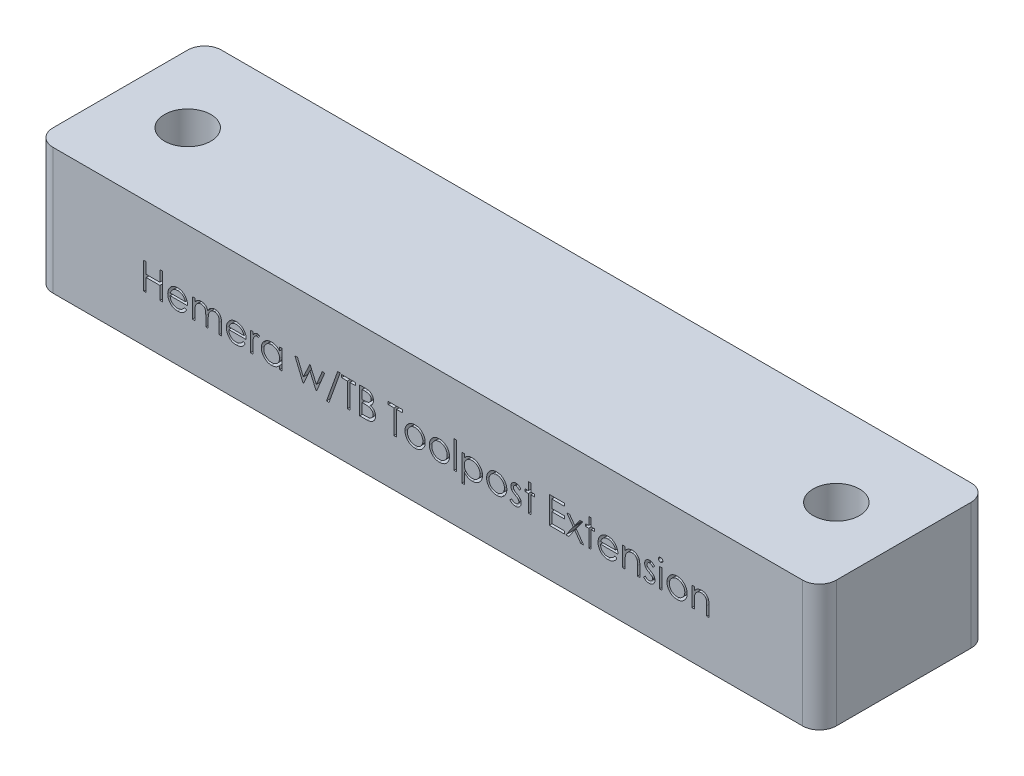
from build123d import *

# Parameters (mm, degrees)
BOSS_EXTRUDE1_DEPTH  = 15
M5_CLEARANCE_HOLE1_D = 5.5
SKETCH4_W            = 0.284935897
SKETCH4_H            = 3.256410257
SKETCH4_H_2          = 2.320192308
CUT_EXTRUDE1_DEPTH   = 1


with BuildPart() as part:
    # Sketch1 → Boss-Extrude1 (new body)
    with BuildSketch(Plane(origin=(0, 0, 0), x_dir=(1, 0, 0), z_dir=(0, 1, 0))):
        with BuildLine():
            Line((-44.5, -10), (44.5, -10))
            ThreePointArc((44.5, -10), (45.914213562, -9.414213562), (46.5, -8))
            Line((46.5, -8), (46.5, 8))
            ThreePointArc((46.5, 8), (45.914213562, 9.414213562), (44.5, 10))
            Line((44.5, 10), (-44.5, 10))
            ThreePointArc((-44.5, 10), (-45.914213562, 9.414213562), (-46.5, 8))
            Line((-46.5, 8), (-46.5, -8))
            ThreePointArc((-46.5, -8), (-45.914213562, -9.414213562), (-44.5, -10))
        make_face()
    extrude(amount=BOSS_EXTRUDE1_DEPTH)

    # M5 Clearance Hole1 (through all)
    with Locations(Plane(origin=(0, 15, 0), x_dir=(1, 0, 0), z_dir=(0, 1, 0))):
        with Locations((38.5, 0), (-38.5, 0)):
            Hole(M5_CLEARANCE_HOLE1_D / 2)

    # Sketch4 → Cut-Extrude1 (cut)
    # profile 1 of 28: a face of its own
    with BuildSketch(Plane.XY.offset(10)):
        Polygon((-33.719557696, 8.774165562), (-33.434621798, 8.774165562), (-33.434621798, 7.47160146), (-31.80641667, 7.47160146), (-31.80641667, 8.774165562), (-31.521480773, 8.774165562), (-31.521480773, 5.599165562), (-31.80641667, 5.599165562), (-31.80641667, 7.145960434), (-33.434621798, 7.145960434), (-33.434621798, 5.599165562), (-33.719557696, 5.599165562), align=None)
    # profile 2 of 28: a face of its own
    with BuildSketch(Plane.XY.offset(10)):
        with BuildLine():
            Line((-28.884551686, 6.33185787), (-28.63141667, 6.198930186))
            add(Edge.make_bspline(
                [(-28.63141667, 6.198930186), (-28.651588439, 6.163149449), (-28.690834712, 6.093534306), (-28.758326819, 5.997892547), (-28.829076771, 5.911852119), (-28.906278227, 5.837711647), (-28.987621436, 5.773076462), (-29.073557487, 5.716527149), (-29.164533772, 5.668341063), (-29.260554594, 5.627744127), (-29.362426329, 5.5965298), (-29.470395848, 5.5744824), (-29.58466999, 5.560854149), (-29.66299831, 5.559271057), (-29.703106374, 5.558460434)],
                knots=[0, 0, 0, 0, 1.120438281, 2.179929193, 3.190490725, 4.156257408, 5.095198341, 6.022838206, 6.959905092, 7.901321166, 8.864066838, 9.862729781, 10.905609505, 12, 12, 12, 12], degree=3))
            add(Edge.make_bspline(
                [(-29.703106374, 5.558460434), (-29.747685168, 5.559501086), (-29.83464548, 5.561531096), (-29.961227965, 5.579032118), (-30.080407866, 5.607582043), (-30.192178482, 5.64746507), (-30.296266097, 5.699559857), (-30.392877587, 5.763023101), (-30.482521014, 5.837528789), (-30.562371547, 5.923722277), (-30.634257069, 6.015962338), (-30.697689777, 6.112079462), (-30.750719018, 6.211831816), (-30.793856029, 6.314584363), (-30.828694728, 6.419689466), (-30.852975952, 6.52810344), (-30.866972937, 6.639532863), (-30.869117827, 6.714914018), (-30.870198721, 6.75290154)],
                knots=[0, 0, 0, 0, 1.145258523, 2.234067595, 3.276747158, 4.290159414, 5.277019952, 6.260822364, 7.254936242, 8.264827045, 9.274100331, 10.257902744, 11.220704747, 12.172965371, 13.118907548, 14.062713208, 15.023725156, 16, 16, 16, 16], degree=3))
            add(Edge.make_bspline(
                [(-30.870198721, 6.75290154), (-30.869237929, 6.788547564), (-30.867333765, 6.859193278), (-30.855331551, 6.963755593), (-30.834060599, 7.065381404), (-30.804872077, 7.164155153), (-30.767179161, 7.25991146), (-30.721067076, 7.352708604), (-30.66646399, 7.442447838), (-30.624306636, 7.499056395), (-30.603071318, 7.527571011)],
                knots=[0, 0, 0, 0, 1.024358464, 2.0301432, 3.019427413, 4.004406732, 4.986367066, 5.972626655, 6.978780325, 8, 8, 8, 8], degree=3))
            add(Edge.make_bspline(
                [(-30.603071318, 7.527571011), (-30.57430792, 7.561923486), (-30.517692275, 7.629540237), (-30.421937581, 7.718384289), (-30.318250975, 7.792809714), (-30.207931857, 7.854501902), (-30.089698055, 7.901377281), (-29.965138913, 7.93630916), (-29.832836131, 7.955883498), (-29.742389252, 7.958648319), (-29.69611018, 7.960062998)],
                knots=[0, 0, 0, 0, 1.030682036, 2.02871468, 2.997146059, 3.962720338, 4.930598197, 5.918074684, 6.934738563, 8, 8, 8, 8], degree=3))
            add(Edge.make_bspline(
                [(-29.69611018, 7.960062998), (-29.648532709, 7.958834682), (-29.555196558, 7.956425007), (-29.419095991, 7.934085404), (-29.290317341, 7.898659158), (-29.16891214, 7.848626791), (-29.054868081, 7.784074912), (-28.94892645, 7.70411767), (-28.849275435, 7.611209834), (-28.791301224, 7.539760351), (-28.761800284, 7.503402341)],
                knots=[0, 0, 0, 0, 1.056321875, 2.072262726, 3.055038591, 4.01806755, 4.982017516, 5.957941055, 6.960871419, 8, 8, 8, 8], degree=3))
            add(Edge.make_bspline(
                [(-28.761800284, 7.503402341), (-28.74172799, 7.476003378), (-28.701717009, 7.421387827), (-28.651599997, 7.332332563), (-28.608095788, 7.239159381), (-28.573322317, 7.140362183), (-28.545165055, 7.037111564), (-28.524793512, 6.928669399), (-28.512846787, 6.815067979), (-28.510498468, 6.737664604), (-28.509301285, 6.698204024)],
                knots=[0, 0, 0, 0, 0.94817472, 1.890038105, 2.849395472, 3.817997239, 4.812318967, 5.836947057, 6.897266129, 8, 8, 8, 8], degree=3))
            Line((-28.509301285, 6.698204024), (-30.585262824, 6.698204024))
            add(Edge.make_bspline(
                [(-30.585262824, 6.698204024), (-30.583866181, 6.667632888), (-30.581119739, 6.607515983), (-30.568315288, 6.51954963), (-30.548132471, 6.435753813), (-30.519766965, 6.356757053), (-30.485416326, 6.28152758), (-30.443337855, 6.210623447), (-30.393136974, 6.14436761), (-30.337142946, 6.082167421), (-30.274815796, 6.026776588), (-30.209245018, 5.977199619), (-30.139491569, 5.935647399), (-30.066105451, 5.901919928), (-29.989205332, 5.875516341), (-29.908766983, 5.85749339), (-29.824948692, 5.845421943), (-29.767811633, 5.844079675), (-29.738723361, 5.843396331)],
                knots=[0, 0, 0, 0, 1.094153842, 2.151609401, 3.174256925, 4.172055639, 5.149267565, 6.128595816, 7.11444997, 8.118368179, 9.117203808, 10.09244225, 11.054858984, 12.015122123, 12.976791628, 13.957293641, 14.960065497, 16, 16, 16, 16], degree=3))
            add(Edge.make_bspline(
                [(-29.738723361, 5.843396331), (-29.710283391, 5.843947926), (-29.653853036, 5.845042394), (-29.569814544, 5.855684914), (-29.487137973, 5.872893664), (-29.406165509, 5.896379583), (-29.328540528, 5.925024299), (-29.256653493, 5.959589034), (-29.190540726, 5.997824876), (-29.128748906, 6.041557938), (-29.068813076, 6.095086794), (-29.009356678, 6.161884912), (-28.945605714, 6.240885741), (-28.905700869, 6.300345023), (-28.884551686, 6.33185787)],
                knots=[0, 0, 0, 0, 0.99110716, 1.966546729, 2.947904876, 3.932708344, 4.903319531, 5.828989031, 6.710028674, 7.56322171, 8.463672341, 9.504779593, 10.677557249, 12, 12, 12, 12], degree=3))
        make_face()
        with BuildLine():
            add(Edge.make_bspline(
                [(-28.794237183, 6.983139921), (-28.804666264, 7.020934099), (-28.824738887, 7.093675727), (-28.866681875, 7.194405677), (-28.913918201, 7.283929702), (-28.969817915, 7.361562655), (-29.033153473, 7.430508699), (-29.106310174, 7.490759844), (-29.188348449, 7.54465996), (-29.278844241, 7.590155442), (-29.374676432, 7.628881242), (-29.475012049, 7.654848311), (-29.577390185, 7.672636968), (-29.646636288, 7.674293509), (-29.681481774, 7.675127101)],
                knots=[0, 0, 0, 0, 1.154881502, 2.222775134, 3.210006277, 4.132804581, 5.035138423, 5.962687519, 6.919655026, 7.923214229, 8.944639381, 9.960483929, 10.97369054, 12, 12, 12, 12], degree=3))
            add(Edge.make_bspline(
                [(-29.681481774, 7.675127101), (-29.709920193, 7.674572227), (-29.766136969, 7.673475359), (-29.848960081, 7.663070313), (-29.928498094, 7.645871025), (-30.00533789, 7.6223171), (-30.078472535, 7.590922154), (-30.149406361, 7.55410737), (-30.21633572, 7.509166076), (-30.258192467, 7.4749134), (-30.279338345, 7.457609072)],
                knots=[0, 0, 0, 0, 1.04873581, 2.073130211, 3.073294108, 4.04793562, 5.032784715, 6.005352987, 6.992311501, 8, 8, 8, 8], degree=3))
            add(Edge.make_bspline(
                [(-30.279338345, 7.457609072), (-30.294481536, 7.443916371), (-30.325127665, 7.416205682), (-30.366076567, 7.368463473), (-30.40528371, 7.316981699), (-30.440964952, 7.259790765), (-30.473692477, 7.197541915), (-30.504317599, 7.130760203), (-30.531882416, 7.058938864), (-30.54739103, 7.00888958), (-30.555369995, 6.983139921)],
                knots=[0, 0, 0, 0, 0.879870761, 1.780643979, 2.707998968, 3.669668524, 4.684282772, 5.740141944, 6.837334558, 8, 8, 8, 8], degree=3))
            Line((-30.555369995, 6.983139921), (-28.794237183, 6.983139921))
        make_face(mode=Mode.SUBTRACT)
    # profile 3 of 28: a face of its own
    with BuildSketch(Plane.XY.offset(10)):
        with BuildLine():
            Line((-27.939429491, 7.91935787), (-27.654493593, 7.91935787))
            Line((-27.654493593, 7.91935787), (-27.654493593, 7.516122694))
            add(Edge.make_bspline(
                [(-27.654493593, 7.516122694), (-27.62883601, 7.551399304), (-27.579673621, 7.618992671), (-27.499059779, 7.708065286), (-27.418527163, 7.783655826), (-27.360530452, 7.823336859), (-27.332668673, 7.842399737)],
                knots=[0, 0, 0, 0, 1.134379233, 2.173579362, 3.122582517, 4, 4, 4, 4], degree=3))
            add(Edge.make_bspline(
                [(-27.332668673, 7.842399737), (-27.294691444, 7.860547461), (-27.219400492, 7.896525847), (-27.100184481, 7.933023433), (-26.978196745, 7.955452632), (-26.895820722, 7.958520021), (-26.854383417, 7.960062998)],
                knots=[0, 0, 0, 0, 1.014936303, 2.012140481, 3.000054389, 4, 4, 4, 4], degree=3))
            add(Edge.make_bspline(
                [(-26.854383417, 7.960062998), (-26.826359056, 7.95911477), (-26.770900352, 7.957238278), (-26.688727642, 7.945028103), (-26.609027329, 7.92392236), (-26.532270317, 7.894524288), (-26.459952272, 7.858921936), (-26.393649929, 7.817148272), (-26.334119397, 7.77025164), (-26.281390765, 7.716114322), (-26.233975292, 7.653216122), (-26.190360909, 7.579860696), (-26.150060895, 7.494400889), (-26.127725851, 7.43238267), (-26.115966951, 7.399731468)],
                knots=[0, 0, 0, 0, 1.009824226, 1.998387844, 2.986035974, 3.974953746, 4.955485308, 5.885931332, 6.793869504, 7.679848016, 8.601185859, 9.625726857, 10.749998409, 12, 12, 12, 12], degree=3))
            add(Edge.make_bspline(
                [(-26.115966951, 7.399731468), (-26.103528887, 7.422160048), (-26.079052524, 7.466296344), (-26.037953839, 7.528760625), (-25.994893767, 7.587186786), (-25.949505334, 7.641621185), (-25.901948744, 7.691795012), (-25.852000188, 7.737874152), (-25.799943994, 7.780056488), (-25.727561033, 7.829335354), (-25.633388168, 7.881678569), (-25.514653949, 7.927061515), (-25.391146294, 7.95510686), (-25.307310239, 7.958400036), (-25.264975364, 7.960062998)],
                knots=[0, 0, 0, 0, 0.86119277, 1.694706429, 2.50939023, 3.298075842, 4.073795165, 4.829715201, 5.57930267, 6.321991688, 7.768977793, 9.186738141, 10.579381044, 12, 12, 12, 12], degree=3))
            add(Edge.make_bspline(
                [(-25.264975364, 7.960062998), (-25.226075751, 7.958595948), (-25.149945432, 7.955724788), (-25.039113198, 7.933179137), (-24.935751704, 7.894464414), (-24.840068927, 7.841638187), (-24.753745382, 7.775254213), (-24.678709873, 7.696270339), (-24.615418187, 7.605245245), (-24.574071849, 7.519618227), (-24.546027288, 7.444021175), (-24.528736025, 7.379608325), (-24.513460016, 7.308713702), (-24.50077703, 7.231252536), (-24.491507343, 7.146951199), (-24.484639623, 7.055947647), (-24.479991356, 6.958171153), (-24.479662905, 6.890711021), (-24.479493593, 6.855936395)],
                knots=[0, 0, 0, 0, 1.209669288, 2.367440248, 3.500751976, 4.631527125, 5.755587489, 6.87532382, 8.007944318, 9.190864318, 9.82315674, 10.514484317, 11.263564316, 12.079023757, 12.955305781, 13.901327259, 14.918167583, 16, 16, 16, 16], degree=3))
            Line((-24.479493593, 6.855936395), (-24.479493593, 5.599165562))
            Line((-24.479493593, 5.599165562), (-24.764429491, 5.599165562))
            Line((-24.764429491, 5.599165562), (-24.764429491, 6.857208431))
            add(Edge.make_bspline(
                [(-24.764429491, 6.857208431), (-24.764500142, 6.886890666), (-24.764635922, 6.943935407), (-24.767079431, 7.025807273), (-24.771683466, 7.100436426), (-24.777067031, 7.167721106), (-24.784545344, 7.227818221), (-24.794202724, 7.280607058), (-24.804433191, 7.326502873), (-24.821429412, 7.37738093), (-24.848596428, 7.43350605), (-24.889977999, 7.494033865), (-24.942111595, 7.546721448), (-25.002309737, 7.592458064), (-25.070842969, 7.629645153), (-25.146375968, 7.656202676), (-25.228439786, 7.672642715), (-25.285247602, 7.67428103), (-25.314584739, 7.675127101)],
                knots=[0, 0, 0, 0, 1.253487763, 2.409012846, 3.458416907, 4.410876679, 5.259312806, 6.014470957, 6.676830364, 7.243083969, 8.276244668, 9.299465089, 10.325150304, 11.392391894, 12.482080715, 13.603491619, 14.762376348, 16, 16, 16, 16], degree=3))
            add(Edge.make_bspline(
                [(-25.314584739, 7.675127101), (-25.350571055, 7.673842444), (-25.421693696, 7.671303473), (-25.525512101, 7.645382888), (-25.625271523, 7.606302946), (-25.717995251, 7.549667789), (-25.80329189, 7.481805916), (-25.876679364, 7.401115925), (-25.937305704, 7.309830206), (-25.978357525, 7.22533284), (-26.004292105, 7.149432702), (-26.021416164, 7.083122943), (-26.034736098, 7.007756092), (-26.047227935, 6.923838583), (-26.055381088, 6.830792776), (-26.062790969, 6.729049084), (-26.066257037, 6.618301492), (-26.066741868, 6.541532996), (-26.066993593, 6.501674577)],
                knots=[0, 0, 0, 0, 1.090531906, 2.155305635, 3.229839962, 4.33261226, 5.44038871, 6.529323825, 7.629011124, 8.757537029, 9.370236727, 10.061839251, 10.834451254, 11.692844982, 12.636905849, 13.66920014, 14.789842145, 16, 16, 16, 16], degree=3))
            Line((-26.066993593, 6.501674577), (-26.066993593, 5.599165562))
            Line((-26.066993593, 5.599165562), (-26.351929491, 5.599165562))
            Line((-26.351929491, 5.599165562), (-26.351929491, 6.778978262))
            add(Edge.make_bspline(
                [(-26.351929491, 6.778978262), (-26.352001546, 6.812264344), (-26.352140173, 6.876303421), (-26.354567975, 6.968136826), (-26.359182268, 7.05166752), (-26.364516765, 7.126798419), (-26.372191356, 7.193392982), (-26.380908783, 7.251808227), (-26.391203594, 7.301897708), (-26.408248703, 7.35683735), (-26.434296828, 7.417362759), (-26.47619618, 7.481897828), (-26.528454485, 7.538383888), (-26.589750922, 7.586606467), (-26.658698934, 7.626467668), (-26.734883876, 7.655187585), (-26.817619761, 7.671901048), (-26.874658823, 7.67403147), (-26.903992792, 7.675127101)],
                knots=[0, 0, 0, 0, 1.320475261, 2.540461679, 3.643808994, 4.639130445, 5.527981419, 6.302341397, 6.981980563, 7.553956391, 8.582137848, 9.585246428, 10.591171744, 11.620968678, 12.668337649, 13.738356861, 14.836885341, 16, 16, 16, 16], degree=3))
            add(Edge.make_bspline(
                [(-26.903992792, 7.675127101), (-26.938478927, 7.673738755), (-27.007208568, 7.670971831), (-27.108175355, 7.646066882), (-27.205680225, 7.607056043), (-27.298167702, 7.552936064), (-27.383143537, 7.485899043), (-27.45753675, 7.407054816), (-27.52007747, 7.317384621), (-27.561562759, 7.233778239), (-27.588322089, 7.159779625), (-27.606097857, 7.096868408), (-27.621373803, 7.027018183), (-27.632725809, 6.950013446), (-27.643684472, 6.86635574), (-27.648973395, 6.77562831), (-27.654118312, 6.677908987), (-27.654365431, 6.610442464), (-27.654493593, 6.575452621)],
                knots=[0, 0, 0, 0, 1.098833095, 2.189935336, 3.297829714, 4.440610912, 5.596351641, 6.740013378, 7.886572111, 9.072425424, 9.705826452, 10.395263256, 11.156850408, 11.985370555, 12.878090359, 13.847760091, 14.883794034, 16, 16, 16, 16], degree=3))
            Line((-27.654493593, 6.575452621), (-27.654493593, 5.599165562))
            Line((-27.654493593, 5.599165562), (-27.939429491, 5.599165562))
            Line((-27.939429491, 5.599165562), (-27.939429491, 7.91935787))
        make_face()
    # profile 4 of 28: a face of its own
    with BuildSketch(Plane.XY.offset(10)):
        with BuildLine():
            Line((-21.923974763, 6.33185787), (-21.670839747, 6.198930186))
            add(Edge.make_bspline(
                [(-21.670839747, 6.198930186), (-21.691011516, 6.163149449), (-21.730257789, 6.093534306), (-21.797749896, 5.997892547), (-21.868499848, 5.911852119), (-21.945701304, 5.837711647), (-22.027044513, 5.773076462), (-22.112980564, 5.716527149), (-22.203956849, 5.668341063), (-22.299977671, 5.627744127), (-22.401849406, 5.5965298), (-22.509818925, 5.5744824), (-22.624093067, 5.560854149), (-22.702421387, 5.559271057), (-22.742529451, 5.558460434)],
                knots=[0, 0, 0, 0, 1.120438281, 2.179929193, 3.190490725, 4.156257408, 5.095198341, 6.022838206, 6.959905092, 7.901321166, 8.864066838, 9.862729781, 10.905609505, 12, 12, 12, 12], degree=3))
            add(Edge.make_bspline(
                [(-22.742529451, 5.558460434), (-22.787108244, 5.559501086), (-22.874068557, 5.561531096), (-23.000651042, 5.579032118), (-23.119830943, 5.607582043), (-23.231601559, 5.64746507), (-23.335689174, 5.699559857), (-23.432300664, 5.763023101), (-23.521944091, 5.837528789), (-23.601794624, 5.923722277), (-23.673680146, 6.015962338), (-23.737112854, 6.112079462), (-23.790142095, 6.211831816), (-23.833279106, 6.314584363), (-23.868117804, 6.419689466), (-23.892399029, 6.52810344), (-23.906396014, 6.639532863), (-23.908540904, 6.714914018), (-23.909621798, 6.75290154)],
                knots=[0, 0, 0, 0, 1.145258523, 2.234067595, 3.276747158, 4.290159414, 5.277019952, 6.260822364, 7.254936242, 8.264827045, 9.274100331, 10.257902744, 11.220704747, 12.172965371, 13.118907548, 14.062713208, 15.023725156, 16, 16, 16, 16], degree=3))
            add(Edge.make_bspline(
                [(-23.909621798, 6.75290154), (-23.908661006, 6.788547564), (-23.906756842, 6.859193278), (-23.894754628, 6.963755593), (-23.873483676, 7.065381404), (-23.844295154, 7.164155153), (-23.806602238, 7.25991146), (-23.760490153, 7.352708604), (-23.705887067, 7.442447838), (-23.663729713, 7.499056395), (-23.642494394, 7.527571011)],
                knots=[0, 0, 0, 0, 1.024358464, 2.0301432, 3.019427413, 4.004406732, 4.986367066, 5.972626655, 6.978780325, 8, 8, 8, 8], degree=3))
            add(Edge.make_bspline(
                [(-23.642494394, 7.527571011), (-23.613730997, 7.561923486), (-23.557115352, 7.629540237), (-23.461360658, 7.718384289), (-23.357674052, 7.792809714), (-23.247354934, 7.854501902), (-23.129121132, 7.901377281), (-23.00456199, 7.93630916), (-22.872259208, 7.955883498), (-22.781812329, 7.958648319), (-22.735533257, 7.960062998)],
                knots=[0, 0, 0, 0, 1.030682036, 2.02871468, 2.997146059, 3.962720338, 4.930598197, 5.918074684, 6.934738563, 8, 8, 8, 8], degree=3))
            add(Edge.make_bspline(
                [(-22.735533257, 7.960062998), (-22.687955786, 7.958834682), (-22.594619634, 7.956425007), (-22.458519068, 7.934085404), (-22.329740417, 7.898659158), (-22.208335217, 7.848626791), (-22.094291158, 7.784074912), (-21.988349527, 7.70411767), (-21.888698512, 7.611209834), (-21.830724301, 7.539760351), (-21.801223361, 7.503402341)],
                knots=[0, 0, 0, 0, 1.056321875, 2.072262726, 3.055038591, 4.01806755, 4.982017516, 5.957941055, 6.960871419, 8, 8, 8, 8], degree=3))
            add(Edge.make_bspline(
                [(-21.801223361, 7.503402341), (-21.781151067, 7.476003378), (-21.741140086, 7.421387827), (-21.691023074, 7.332332563), (-21.647518865, 7.239159381), (-21.612745394, 7.140362183), (-21.584588132, 7.037111564), (-21.564216589, 6.928669399), (-21.552269864, 6.815067979), (-21.549921545, 6.737664604), (-21.548724362, 6.698204024)],
                knots=[0, 0, 0, 0, 0.94817472, 1.890038105, 2.849395472, 3.817997239, 4.812318967, 5.836947057, 6.897266129, 8, 8, 8, 8], degree=3))
            Line((-21.548724362, 6.698204024), (-23.624685901, 6.698204024))
            add(Edge.make_bspline(
                [(-23.624685901, 6.698204024), (-23.623289258, 6.667632888), (-23.620542816, 6.607515983), (-23.607738365, 6.51954963), (-23.587555548, 6.435753813), (-23.559190041, 6.356757053), (-23.524839403, 6.28152758), (-23.482760932, 6.210623447), (-23.432560051, 6.14436761), (-23.376566023, 6.082167421), (-23.314238872, 6.026776588), (-23.248668095, 5.977199619), (-23.178914646, 5.935647399), (-23.105528528, 5.901919928), (-23.028628408, 5.875516341), (-22.94819006, 5.85749339), (-22.864371769, 5.845421943), (-22.80723471, 5.844079675), (-22.778146438, 5.843396331)],
                knots=[0, 0, 0, 0, 1.094153842, 2.151609401, 3.174256925, 4.172055639, 5.149267565, 6.128595816, 7.11444997, 8.118368179, 9.117203808, 10.09244225, 11.054858984, 12.015122123, 12.976791628, 13.957293641, 14.960065497, 16, 16, 16, 16], degree=3))
            add(Edge.make_bspline(
                [(-22.778146438, 5.843396331), (-22.749706468, 5.843947926), (-22.693276113, 5.845042394), (-22.609237621, 5.855684914), (-22.526561049, 5.872893664), (-22.445588586, 5.896379583), (-22.367963604, 5.925024299), (-22.29607657, 5.959589034), (-22.229963803, 5.997824876), (-22.168171983, 6.041557938), (-22.108236153, 6.095086794), (-22.048779755, 6.161884912), (-21.985028791, 6.240885741), (-21.945123946, 6.300345023), (-21.923974763, 6.33185787)],
                knots=[0, 0, 0, 0, 0.99110716, 1.966546729, 2.947904876, 3.932708344, 4.903319531, 5.828989031, 6.710028674, 7.56322171, 8.463672341, 9.504779593, 10.677557249, 12, 12, 12, 12], degree=3))
        make_face()
        with BuildLine():
            add(Edge.make_bspline(
                [(-21.83366026, 6.983139921), (-21.844089341, 7.020934099), (-21.864161964, 7.093675727), (-21.906104952, 7.194405677), (-21.953341278, 7.283929702), (-22.009240992, 7.361562655), (-22.07257655, 7.430508699), (-22.145733251, 7.490759844), (-22.227771526, 7.54465996), (-22.318267318, 7.590155442), (-22.414099509, 7.628881242), (-22.514435126, 7.654848311), (-22.616813262, 7.672636968), (-22.686059364, 7.674293509), (-22.720904851, 7.675127101)],
                knots=[0, 0, 0, 0, 1.154881502, 2.222775134, 3.210006277, 4.132804581, 5.035138423, 5.962687519, 6.919655026, 7.923214229, 8.944639381, 9.960483929, 10.97369054, 12, 12, 12, 12], degree=3))
            add(Edge.make_bspline(
                [(-22.720904851, 7.675127101), (-22.74934327, 7.674572227), (-22.805560046, 7.673475359), (-22.888383158, 7.663070313), (-22.967921171, 7.645871025), (-23.044760967, 7.6223171), (-23.117895612, 7.590922154), (-23.188829438, 7.55410737), (-23.255758797, 7.509166076), (-23.297615544, 7.4749134), (-23.318761422, 7.457609072)],
                knots=[0, 0, 0, 0, 1.04873581, 2.073130211, 3.073294108, 4.04793562, 5.032784715, 6.005352987, 6.992311501, 8, 8, 8, 8], degree=3))
            add(Edge.make_bspline(
                [(-23.318761422, 7.457609072), (-23.333904613, 7.443916371), (-23.364550742, 7.416205682), (-23.405499644, 7.368463473), (-23.444706787, 7.316981699), (-23.480388029, 7.259790765), (-23.513115554, 7.197541915), (-23.543740676, 7.130760203), (-23.571305493, 7.058938864), (-23.586814107, 7.00888958), (-23.594793072, 6.983139921)],
                knots=[0, 0, 0, 0, 0.879870761, 1.780643979, 2.707998968, 3.669668524, 4.684282772, 5.740141944, 6.837334558, 8, 8, 8, 8], degree=3))
            Line((-23.594793072, 6.983139921), (-21.83366026, 6.983139921))
        make_face(mode=Mode.SUBTRACT)
    # profile 5 of 28: a face of its own
    with BuildSketch(Plane.XY.offset(10)):
        with BuildLine():
            Line((-21.060262824, 7.91935787), (-20.775326927, 7.91935787))
            Line((-20.775326927, 7.91935787), (-20.775326927, 7.577816403))
            add(Edge.make_bspline(
                [(-20.775326927, 7.577816403), (-20.75429141, 7.609617048), (-20.714061147, 7.670435533), (-20.64719299, 7.750871256), (-20.578700682, 7.817469191), (-20.508256334, 7.87054024), (-20.435341914, 7.910284998), (-20.36155768, 7.939397965), (-20.285742789, 7.956613101), (-20.234795901, 7.958911492), (-20.209271237, 7.960062998)],
                knots=[0, 0, 0, 0, 1.2804753, 2.448899062, 3.506932113, 4.484331642, 5.4025378, 6.288909075, 7.142734305, 8, 8, 8, 8], degree=3))
            add(Edge.make_bspline(
                [(-20.209271237, 7.960062998), (-20.189471641, 7.95898302), (-20.148732685, 7.956760896), (-20.087062765, 7.941148219), (-20.023523348, 7.916221727), (-19.982572753, 7.892780954), (-19.961224362, 7.880560794)],
                knots=[0, 0, 0, 0, 0.901110191, 1.854092781, 2.881294221, 4, 4, 4, 4], degree=3))
            Line((-19.961224362, 7.880560794), (-20.117684699, 7.633785955))
            add(Edge.make_bspline(
                [(-20.117684699, 7.633785955), (-20.13139074, 7.639900339), (-20.157407428, 7.651506611), (-20.195466214, 7.665242577), (-20.230555712, 7.673330587), (-20.25291094, 7.67455588), (-20.263332736, 7.675127101)],
                knots=[0, 0, 0, 0, 1.180555205, 2.24091978, 3.179933427, 4, 4, 4, 4], degree=3))
            add(Edge.make_bspline(
                [(-20.263332736, 7.675127101), (-20.286197937, 7.673603067), (-20.332836319, 7.670494479), (-20.401311544, 7.646057132), (-20.467757223, 7.606573522), (-20.520527231, 7.562784727), (-20.561386989, 7.520559225), (-20.590542765, 7.483685317), (-20.617287828, 7.442338987), (-20.642842242, 7.39722706), (-20.666125238, 7.347579271), (-20.687855545, 7.293891642), (-20.707503228, 7.236101989), (-20.718706664, 7.195840703), (-20.724445516, 7.175217245)],
                knots=[0, 0, 0, 0, 1.125678352, 2.296057538, 3.5422874, 4.923748041, 5.663163013, 6.437101912, 7.23742474, 8.08941207, 8.991984279, 9.93940061, 10.944477711, 12, 12, 12, 12], degree=3))
            add(Edge.make_bspline(
                [(-20.724445516, 7.175217245), (-20.728738473, 7.156822952), (-20.738247046, 7.11608099), (-20.747492227, 7.047729114), (-20.756626718, 6.966971938), (-20.763064365, 6.873584671), (-20.769031589, 6.767800526), (-20.772397164, 6.649458347), (-20.775212155, 6.518436664), (-20.775287509, 6.426838501), (-20.775326927, 6.378923174)],
                knots=[0, 0, 0, 0, 0.566838948, 1.255505196, 2.06880316, 3.007127437, 4.065329342, 5.249902469, 6.561414163, 8, 8, 8, 8], degree=3))
            Line((-20.775326927, 6.378923174), (-20.775326927, 5.599165562))
            Line((-20.775326927, 5.599165562), (-21.060262824, 5.599165562))
            Line((-21.060262824, 5.599165562), (-21.060262824, 7.91935787))
        make_face()
    # profile 6 of 28: a face of its own
    with BuildSketch(Plane.XY.offset(10)):
        with BuildLine():
            Line((-17.315391029, 7.91935787), (-17.315391029, 5.599165562))
            Line((-17.315391029, 5.599165562), (-17.600326927, 5.599165562))
            Line((-17.600326927, 5.599165562), (-17.600326927, 6.000492686))
            add(Edge.make_bspline(
                [(-17.600326927, 6.000492686), (-17.632456829, 5.964171054), (-17.695158739, 5.893288933), (-17.799880325, 5.800685819), (-17.910885743, 5.724142628), (-18.027636227, 5.662320918), (-18.150026348, 5.61588241), (-18.277784799, 5.582874966), (-18.410963694, 5.561653415), (-18.501906902, 5.55953431), (-18.547993193, 5.558460434)],
                knots=[0, 0, 0, 0, 1.074387032, 2.096679803, 3.090159297, 4.057316773, 5.018401886, 5.985159533, 6.978961417, 8, 8, 8, 8], degree=3))
            add(Edge.make_bspline(
                [(-18.547993193, 5.558460434), (-18.588966979, 5.559572929), (-18.669769101, 5.561766818), (-18.788631192, 5.578786908), (-18.903014876, 5.606119686), (-19.013028238, 5.644129778), (-19.117959398, 5.694549524), (-19.218706772, 5.754911942), (-19.314748428, 5.826794695), (-19.404620467, 5.908970977), (-19.487380925, 5.998229287), (-19.560007936, 6.09342989), (-19.620562516, 6.194161123), (-19.671199303, 6.299147627), (-19.71020313, 6.40919759), (-19.737393498, 6.523930449), (-19.754393761, 6.643210549), (-19.756586743, 6.724435688), (-19.757698721, 6.765621892)],
                knots=[0, 0, 0, 0, 1.033919861, 2.038935746, 3.024066025, 3.998881131, 4.97069526, 5.957263378, 6.95902576, 7.993208707, 9.027059324, 10.027763471, 11.009749337, 11.988697705, 12.965288445, 13.950418724, 14.960734635, 16, 16, 16, 16], degree=3))
            add(Edge.make_bspline(
                [(-19.757698721, 6.765621892), (-19.756562097, 6.805956823), (-19.754315053, 6.885696806), (-19.737575346, 7.002971054), (-19.709425789, 7.115926904), (-19.66992167, 7.224200703), (-19.619265039, 7.327923463), (-19.55764456, 7.427168543), (-19.485055783, 7.522209353), (-19.401369671, 7.610811109), (-19.310714558, 7.692654095), (-19.213733066, 7.7637823), (-19.112837661, 7.825211156), (-19.006463358, 7.873882524), (-18.896184628, 7.913260783), (-18.781019716, 7.940504975), (-18.661447784, 7.956558974), (-18.580267123, 7.958883767), (-18.539088946, 7.960062998)],
                knots=[0, 0, 0, 0, 1.020392517, 2.01726096, 2.990465484, 3.961182959, 4.928053699, 5.906110375, 6.912531644, 7.948652711, 8.985773172, 9.998621852, 10.987621588, 11.969261332, 12.953316658, 13.946091881, 14.958173133, 16, 16, 16, 16], degree=3))
            add(Edge.make_bspline(
                [(-18.539088946, 7.960062998), (-18.491736216, 7.958758752), (-18.398879749, 7.956201187), (-18.263055055, 7.934917142), (-18.134563279, 7.898959389), (-18.012412545, 7.850048516), (-17.897041494, 7.785052883), (-17.789542358, 7.703065347), (-17.688790098, 7.604602985), (-17.630387977, 7.528974081), (-17.600326927, 7.490045971)],
                knots=[0, 0, 0, 0, 1.038897134, 2.037228247, 3.008116434, 3.962042015, 4.918381754, 5.904844433, 6.921570401, 8, 8, 8, 8], degree=3))
            Line((-17.600326927, 7.490045971), (-17.600326927, 7.91935787))
            Line((-17.600326927, 7.91935787), (-17.315391029, 7.91935787))
        make_face()
        with BuildLine():
            add(Edge.make_bspline(
                [(-18.53527284, 7.675127101), (-18.576923704, 7.673645158), (-18.659135884, 7.670720038), (-18.7798258, 7.647884082), (-18.895317254, 7.609888771), (-19.005032621, 7.557925904), (-19.107238789, 7.49258555), (-19.198582334, 7.413554009), (-19.279810355, 7.322987575), (-19.348125709, 7.221294947), (-19.40381566, 7.11227625), (-19.442974325, 6.998316938), (-19.468799999, 6.881472423), (-19.471438443, 6.802221986), (-19.472762824, 6.762441804)],
                knots=[0, 0, 0, 0, 1.031046209, 2.035121221, 3.029706178, 4.034933723, 5.034054252, 6.02443088, 7.017295772, 8.038157696, 9.050218397, 10.03989886, 11.016116709, 12, 12, 12, 12], degree=3))
            add(Edge.make_bspline(
                [(-19.472762824, 6.762441804), (-19.471071099, 6.72289935), (-19.467694281, 6.643969434), (-19.44342758, 6.526965625), (-19.402715123, 6.412979458), (-19.347159823, 6.302978414), (-19.277594099, 6.200848552), (-19.196959393, 6.108555726), (-19.104475924, 6.029190171), (-19.002034542, 5.962753229), (-18.892625883, 5.909084371), (-18.777569388, 5.871741255), (-18.659027917, 5.847631412), (-18.578426157, 5.844815208), (-18.53781691, 5.843396331)],
                knots=[0, 0, 0, 0, 0.979072187, 1.954306742, 2.945804271, 3.96968567, 4.997920485, 5.998718438, 6.996577872, 8.005894225, 9.015743152, 10.005417472, 10.995077863, 12, 12, 12, 12], degree=3))
            add(Edge.make_bspline(
                [(-18.53781691, 5.843396331), (-18.49659044, 5.844902156), (-18.414595079, 5.847897091), (-18.293547109, 5.87083081), (-18.176076678, 5.908721077), (-18.063783978, 5.961243857), (-17.959175774, 6.02633803), (-17.865288413, 6.102544462), (-17.785898928, 6.191175208), (-17.718595632, 6.28858099), (-17.665822218, 6.395362587), (-17.627381079, 6.509058603), (-17.604653607, 6.629672996), (-17.601789095, 6.712099558), (-17.600326927, 6.754173575)],
                knots=[0, 0, 0, 0, 1.01762866, 2.023962475, 3.030623092, 4.058876274, 5.077231937, 6.066672613, 7.034107872, 8.005628644, 8.981990164, 9.965428785, 10.961468474, 12, 12, 12, 12], degree=3))
            add(Edge.make_bspline(
                [(-17.600326927, 6.754173575), (-17.601197472, 6.786230035), (-17.602910981, 6.849327294), (-17.616001569, 6.941971542), (-17.636824966, 7.030629994), (-17.666167564, 7.115395862), (-17.704713229, 7.195800483), (-17.751202273, 7.27242118), (-17.806452217, 7.34485945), (-17.869573663, 7.412117807), (-17.938666382, 7.473464669), (-18.011777144, 7.528223659), (-18.08977215, 7.57320776), (-18.171339748, 7.610438056), (-18.256621459, 7.640064571), (-18.346311235, 7.659829122), (-18.439455745, 7.67340027), (-18.502997524, 7.67454543), (-18.53527284, 7.675127101)],
                knots=[0, 0, 0, 0, 1.050140795, 2.067009409, 3.05949893, 4.030605086, 5.00011959, 5.97591094, 6.962425594, 7.979863591, 8.993523472, 9.986985069, 10.967611495, 11.937549037, 12.921786183, 13.919465291, 14.943216303, 16, 16, 16, 16], degree=3))
        make_face(mode=Mode.SUBTRACT)
    # profile 7 of 28: a face of its own
    with BuildSketch(Plane.XY.offset(10)):
        Polygon((-15.768596157, 7.91935787), (-15.462671678, 7.91935787), (-14.771320516, 6.250447613), (-14.013823521, 7.91935787), (-13.965486181, 7.91935787), (-13.224525644, 6.250447613), (-12.526814306, 7.91935787), (-12.227250003, 7.91935787), (-13.197176886, 5.599165562), (-13.256326526, 5.599165562), (-13.99792308, 7.268075819), (-14.754784058, 5.599165562), (-14.807573521, 5.599165562), align=None)
    # profile 8 of 28: a face of its own
    with BuildSketch(Plane.XY.offset(10)):
        Polygon((-10.395519234, 8.855575819), (-11.723524042, 5.151409152), (-12.023724362, 5.151409152), (-10.695719555, 8.855575819), align=None)
    # profile 9 of 28: a face of its own
    with BuildSketch(Plane.XY.offset(10)):
        Polygon((-10.232698721, 8.448524536), (-10.232698721, 8.774165562), (-8.563788465, 8.774165562), (-8.563788465, 8.448524536), (-9.255775644, 8.448524536), (-9.255775644, 5.599165562), (-9.540711542, 5.599165562), (-9.540711542, 8.448524536), align=None)
    # profile 10 of 28: a face of its own
    with BuildSketch(Plane.XY.offset(10)):
        with BuildLine():
            Line((-8.075326927, 8.774165562), (-7.455845757, 8.774165562))
            add(Edge.make_bspline(
                [(-7.455845757, 8.774165562), (-7.425521351, 8.774006131), (-7.366745107, 8.773697115), (-7.281274613, 8.76890456), (-7.201220335, 8.762369803), (-7.126559056, 8.752001076), (-7.057325276, 8.739489964), (-6.993310348, 8.72433903), (-6.934717834, 8.706172031), (-6.864765566, 8.677282904), (-6.785008967, 8.63435403), (-6.698650425, 8.570918832), (-6.624805151, 8.493328669), (-6.561136134, 8.405805117), (-6.510516547, 8.30952481), (-6.473895828, 8.206782546), (-6.450711183, 8.098903537), (-6.448326818, 8.024841511), (-6.447121798, 7.987411756)],
                knots=[0, 0, 0, 0, 1.001505555, 1.941167018, 2.826882275, 3.653841531, 4.429895133, 5.150066043, 5.825578002, 6.45369114, 7.647487171, 8.808567382, 9.977351308, 11.170798116, 12.373658725, 13.556498008, 14.765093433, 16, 16, 16, 16], degree=3))
            add(Edge.make_bspline(
                [(-6.447121798, 7.987411756), (-6.448113504, 7.952348366), (-6.450062298, 7.883445499), (-6.468697515, 7.782667271), (-6.497871836, 7.686735808), (-6.538425884, 7.596001216), (-6.591132694, 7.512513581), (-6.653597026, 7.435599418), (-6.728959554, 7.368515245), (-6.785423065, 7.331011326), (-6.81410397, 7.311961035)],
                knots=[0, 0, 0, 0, 1.044552857, 2.05264487, 3.044412934, 4.028983338, 5.005914585, 5.980388656, 6.974128949, 8, 8, 8, 8], degree=3))
            add(Edge.make_bspline(
                [(-6.81410397, 7.311961035), (-6.778035582, 7.2981135), (-6.709027821, 7.271619736), (-6.614062653, 7.224778994), (-6.532243043, 7.173831936), (-6.462939918, 7.118195186), (-6.403669331, 7.058225051), (-6.351914163, 6.993042197), (-6.307753202, 6.921796324), (-6.269913621, 6.84523026), (-6.24038725, 6.764125821), (-6.218274822, 6.67924376), (-6.20560435, 6.590888449), (-6.203801276, 6.53075814), (-6.202891029, 6.500402541)],
                knots=[0, 0, 0, 0, 1.27268992, 2.434971085, 3.483601985, 4.442670788, 5.356604649, 6.2567628, 7.179492994, 8.113709626, 9.066344395, 10.018646069, 10.999752585, 12, 12, 12, 12], degree=3))
            add(Edge.make_bspline(
                [(-6.202891029, 6.500402541), (-6.203777168, 6.469408307), (-6.205520671, 6.408426284), (-6.218383931, 6.318841269), (-6.240163621, 6.23322971), (-6.270163875, 6.151037866), (-6.309318261, 6.072424744), (-6.356968628, 5.997301283), (-6.413784404, 5.926422283), (-6.477341435, 5.859000139), (-6.549243524, 5.798377789), (-6.62681853, 5.744388541), (-6.711043406, 5.69998747), (-6.800534858, 5.662689365), (-6.896296773, 5.634198549), (-6.997899139, 5.614266286), (-7.105254327, 5.600836002), (-7.178923172, 5.599731824), (-7.216703128, 5.599165562)],
                knots=[0, 0, 0, 0, 0.978564426, 1.925352924, 2.850884081, 3.763762016, 4.682927383, 5.618979971, 6.567305752, 7.547517671, 8.540179244, 9.531824382, 10.526200242, 11.540722885, 12.589160233, 13.674978461, 14.80764778, 16, 16, 16, 16], degree=3))
            Line((-7.216703128, 5.599165562), (-8.075326927, 5.599165562))
            Line((-8.075326927, 5.599165562), (-8.075326927, 8.774165562))
        make_face()
        with BuildLine():
            Line((-7.790391029, 8.448524536), (-7.790391029, 7.430896331))
            Line((-7.790391029, 7.430896331), (-7.598949723, 7.430896331))
            add(Edge.make_bspline(
                [(-7.598949723, 7.430896331), (-7.570965459, 7.431259119), (-7.516894157, 7.431960098), (-7.438589679, 7.433968074), (-7.365904841, 7.439590585), (-7.298965107, 7.44521148), (-7.23787589, 7.45435057), (-7.18277253, 7.465229138), (-7.132790231, 7.476734345), (-7.075150787, 7.496300951), (-7.009770326, 7.525218556), (-6.940071725, 7.570096579), (-6.878626884, 7.623549385), (-6.826740864, 7.685226901), (-6.784276173, 7.753141226), (-6.754781588, 7.826208754), (-6.734781552, 7.902608445), (-6.732974949, 7.95505786), (-6.732057696, 7.981687597)],
                knots=[0, 0, 0, 0, 1.156816544, 2.235205308, 3.236616184, 4.169592532, 5.011045266, 5.787822928, 6.49130361, 7.128639758, 8.301311294, 9.436451833, 10.541879658, 11.654887649, 12.756523258, 13.837046038, 14.901820046, 16, 16, 16, 16], degree=3))
            add(Edge.make_bspline(
                [(-6.732057696, 7.981687597), (-6.732535016, 7.999309547), (-6.733471333, 8.033876926), (-6.741139686, 8.084268126), (-6.754173128, 8.131660673), (-6.770913809, 8.176704044), (-6.794307833, 8.217989794), (-6.821851832, 8.256945408), (-6.855130994, 8.292244258), (-6.893010842, 8.325236589), (-6.936561521, 8.354486982), (-6.98575705, 8.380105388), (-7.041263015, 8.400734521), (-7.102143962, 8.418801317), (-7.16933702, 8.431490698), (-7.242066793, 8.442061985), (-7.320929002, 8.44744383), (-7.375489203, 8.448156266), (-7.403692311, 8.448524536)],
                knots=[0, 0, 0, 0, 0.91205012, 1.789085906, 2.630437955, 3.453916878, 4.269457761, 5.079663411, 5.91843418, 6.774407191, 7.675494373, 8.627863946, 9.638891023, 10.736472738, 11.911756761, 13.175263542, 14.539845004, 16, 16, 16, 16], degree=3))
            Line((-7.403692311, 8.448524536), (-7.790391029, 8.448524536))
        make_face(mode=Mode.SUBTRACT)
        with BuildLine():
            Line((-7.790391029, 7.105255306), (-7.790391029, 5.924806588))
            Line((-7.790391029, 5.924806588), (-7.384611782, 5.924806588))
            add(Edge.make_bspline(
                [(-7.384611782, 5.924806588), (-7.355566042, 5.925154701), (-7.299584208, 5.925825645), (-7.218756663, 5.928015991), (-7.143841991, 5.932998269), (-7.075182039, 5.94084129), (-7.012035414, 5.949348883), (-6.955159641, 5.960789117), (-6.904093672, 5.973896388), (-6.84488055, 5.994156673), (-6.778202368, 6.025631329), (-6.706346805, 6.073087805), (-6.642460164, 6.129623949), (-6.588208251, 6.195056992), (-6.543746468, 6.26620541), (-6.511401877, 6.341630121), (-6.491453028, 6.420084849), (-6.48903806, 6.473576081), (-6.487826927, 6.500402541)],
                knots=[0, 0, 0, 0, 1.160039823, 2.235823828, 3.228722157, 4.157150951, 4.99529583, 5.772374946, 6.472645482, 7.099169577, 8.269452708, 9.405989375, 10.527446681, 11.663510218, 12.788923519, 13.866172445, 14.929861265, 16, 16, 16, 16], degree=3))
            add(Edge.make_bspline(
                [(-6.487826927, 6.500402541), (-6.488077393, 6.517178643), (-6.488574285, 6.550460247), (-6.496067843, 6.599369597), (-6.506966139, 6.646745925), (-6.521055368, 6.692717875), (-6.541574456, 6.736454295), (-6.565528965, 6.778820188), (-6.593615379, 6.819871559), (-6.63737973, 6.871771246), (-6.701035744, 6.931567393), (-6.791484033, 6.990112128), (-6.894328904, 7.037326924), (-6.968920986, 7.057374306), (-7.007453329, 7.067730266)],
                knots=[0, 0, 0, 0, 0.723448775, 1.435228256, 2.130040452, 2.821711965, 3.505591119, 4.210454504, 4.921174351, 5.648778258, 7.137944449, 8.670945889, 10.280296675, 12, 12, 12, 12], degree=3))
            add(Edge.make_bspline(
                [(-7.007453329, 7.067730266), (-7.022901151, 7.07086452), (-7.056395217, 7.077660231), (-7.111012094, 7.084833648), (-7.173365346, 7.091224524), (-7.243598956, 7.095951788), (-7.321801784, 7.100838152), (-7.408140846, 7.102738455), (-7.502263553, 7.10500564), (-7.567570919, 7.105169955), (-7.601493794, 7.105255306)],
                knots=[0, 0, 0, 0, 0.634451884, 1.375622551, 2.216452059, 3.157844607, 4.20941857, 5.370758133, 6.634282058, 8, 8, 8, 8], degree=3))
            Line((-7.601493794, 7.105255306), (-7.790391029, 7.105255306))
        make_face(mode=Mode.SUBTRACT)
    # profile 11 of 28: a face of its own
    with BuildSketch(Plane.XY.offset(10)):
        Polygon((-4.696801285, 8.448524536), (-4.696801285, 8.774165562), (-3.027891029, 8.774165562), (-3.027891029, 8.448524536), (-3.719878209, 8.448524536), (-3.719878209, 5.599165562), (-4.004814106, 5.599165562), (-4.004814106, 8.448524536), align=None)
    # profile 12 of 28: a face of its own
    with BuildSketch(Plane.XY.offset(10)):
        with BuildLine():
            add(Edge.make_bspline(
                [(-1.500176686, 7.960062998), (-1.456641746, 7.959135997), (-1.371280367, 7.957318374), (-1.246268928, 7.937891941), (-1.126938697, 7.908185403), (-1.012832652, 7.867117629), (-0.905412155, 7.812070431), (-0.803112526, 7.74638486), (-0.70621424, 7.668567793), (-0.648136206, 7.608371545), (-0.618656253, 7.577816403)],
                knots=[0, 0, 0, 0, 1.054011418, 2.066658804, 3.057071809, 4.030435133, 4.997543892, 5.974964718, 6.972108034, 8, 8, 8, 8], degree=3))
            add(Edge.make_bspline(
                [(-0.618656253, 7.577816403), (-0.593272624, 7.548593716), (-0.542996607, 7.490713882), (-0.478529848, 7.396864861), (-0.422993147, 7.299673484), (-0.378486033, 7.197849124), (-0.34339319, 7.092280672), (-0.318477879, 6.982605276), (-0.303657946, 6.869065147), (-0.30165954, 6.791954522), (-0.300647439, 6.75290154)],
                knots=[0, 0, 0, 0, 1.025258237, 2.030674902, 3.01204498, 3.988269485, 4.97094183, 5.956517959, 6.965070386, 8, 8, 8, 8], degree=3))
            add(Edge.make_bspline(
                [(-0.300647439, 6.75290154), (-0.301537652, 6.713622202), (-0.303296755, 6.636004398), (-0.319937036, 6.52168683), (-0.345818806, 6.41083867), (-0.382859117, 6.303923998), (-0.430355402, 6.200616004), (-0.488313383, 6.101365913), (-0.557139778, 6.005977906), (-0.635157689, 5.915261953), (-0.72138332, 5.83165403), (-0.814924397, 5.758784814), (-0.913942699, 5.696353859), (-1.019754884, 5.646065111), (-1.131394676, 5.606414169), (-1.249102873, 5.578564868), (-1.372696616, 5.561726769), (-1.457085595, 5.559564528), (-1.500176686, 5.558460434)],
                knots=[0, 0, 0, 0, 0.998656419, 1.973391657, 2.932242238, 3.890759089, 4.846373663, 5.82037756, 6.809684879, 7.83454468, 8.860553229, 9.859544525, 10.845671541, 11.83227036, 12.833544569, 13.85385346, 14.904124723, 16, 16, 16, 16], degree=3))
            add(Edge.make_bspline(
                [(-1.500176686, 5.558460434), (-1.543478896, 5.559568233), (-1.628288462, 5.561737914), (-1.752318459, 5.57849945), (-1.870237614, 5.606401334), (-1.982023557, 5.646195416), (-2.088290668, 5.696355467), (-2.187882704, 5.758596071), (-2.281499771, 5.83167564), (-2.367743642, 5.915256098), (-2.445756663, 6.005979415), (-2.51458432, 6.101365521), (-2.572541973, 6.200616106), (-2.620038344, 6.30392397), (-2.657078631, 6.410838677), (-2.682960408, 6.521686828), (-2.699600687, 6.636004398), (-2.70135979, 6.713622202), (-2.702250003, 6.75290154)],
                knots=[0, 0, 0, 0, 1.099876186, 2.154163076, 3.173186993, 4.173200201, 5.163417411, 6.152872554, 7.150605724, 8.17532212, 9.198891216, 10.186952605, 11.159729845, 12.11414092, 13.071450619, 14.029093627, 15.002601286, 16, 16, 16, 16], degree=3))
            add(Edge.make_bspline(
                [(-2.702250003, 6.75290154), (-2.701231, 6.791742263), (-2.69921355, 6.868640221), (-2.684408517, 6.981966912), (-2.659590397, 7.091456686), (-2.624455488, 7.196617654), (-2.579538136, 7.2979958), (-2.524781825, 7.395427325), (-2.459657465, 7.488851972), (-2.409581409, 7.546657002), (-2.384241189, 7.575908351)],
                knots=[0, 0, 0, 0, 1.031353054, 2.041901799, 3.029428768, 4.008703097, 4.981709435, 5.96992636, 6.972712378, 8, 8, 8, 8], degree=3))
            add(Edge.make_bspline(
                [(-2.384241189, 7.575908351), (-2.354805682, 7.606728474), (-2.296915577, 7.66734167), (-2.199534945, 7.744931888), (-2.097486979, 7.811984327), (-1.988879367, 7.865937751), (-1.87486706, 7.908426977), (-1.754925319, 7.937968552), (-1.629489673, 7.957248381), (-1.543710588, 7.959115442), (-1.500176686, 7.960062998)],
                knots=[0, 0, 0, 0, 1.027980169, 2.021703884, 2.998553061, 3.971491411, 4.943284454, 5.930300938, 6.949603206, 8, 8, 8, 8], degree=3))
        make_face()
        with BuildLine():
            add(Edge.make_bspline(
                [(-1.501448721, 7.675127101), (-1.532234983, 7.674252078), (-1.593012764, 7.672524622), (-1.682474816, 7.659385651), (-1.768599098, 7.638568987), (-1.851549007, 7.60899245), (-1.931044813, 7.570802735), (-2.007162628, 7.523895865), (-2.080126342, 7.468893112), (-2.148508642, 7.405880545), (-2.211266882, 7.337047457), (-2.266129047, 7.263706446), (-2.312778965, 7.187047118), (-2.351641109, 7.106989755), (-2.380585487, 7.022723065), (-2.401606729, 6.935201349), (-2.414733304, 6.844246293), (-2.416444519, 6.782414512), (-2.417314106, 6.750993487)],
                knots=[0, 0, 0, 0, 1.021534396, 2.016698045, 2.994645724, 3.958388632, 4.93408049, 5.916473867, 6.921342795, 7.962252576, 8.998418191, 10.008913653, 10.997312074, 11.973003931, 12.956656626, 13.948281152, 14.957379055, 16, 16, 16, 16], degree=3))
            add(Edge.make_bspline(
                [(-2.417314106, 6.750993487), (-2.415856487, 6.710397005), (-2.412963387, 6.62982058), (-2.389436423, 6.511156204), (-2.350078869, 6.397235524), (-2.296931836, 6.288726374), (-2.230341909, 6.188330808), (-2.151885785, 6.098821675), (-2.062405485, 6.021545975), (-1.96296766, 5.957428351), (-1.855603386, 5.90648343), (-1.741978009, 5.870380073), (-1.623468236, 5.846910752), (-1.542477859, 5.844578057), (-1.501448721, 5.843396331)],
                knots=[0, 0, 0, 0, 1.016792936, 2.018143844, 3.017858371, 4.030088057, 5.03801393, 6.028138512, 7.003788237, 7.991172063, 8.984598303, 9.972568034, 10.972917682, 12, 12, 12, 12], degree=3))
            add(Edge.make_bspline(
                [(-1.501448721, 5.843396331), (-1.460421944, 5.844584943), (-1.379436225, 5.846931229), (-1.261091114, 5.870261872), (-1.147776297, 5.906641622), (-1.040523538, 5.957371055), (-0.941130977, 6.02178946), (-0.851007131, 6.098385316), (-0.773220891, 6.188567881), (-0.706696835, 6.288859354), (-0.652679432, 6.397067302), (-0.613506099, 6.51117723), (-0.589922575, 6.629815225), (-0.587037109, 6.710395211), (-0.585583337, 6.750993487)],
                knots=[0, 0, 0, 0, 1.02726834, 2.027799167, 3.010890988, 4.004497153, 4.992059811, 5.971914811, 6.958719428, 7.966827853, 8.981595046, 9.981490638, 10.983022906, 12, 12, 12, 12], degree=3))
            add(Edge.make_bspline(
                [(-0.585583337, 6.750993487), (-0.586452625, 6.7824147), (-0.58816325, 6.84424685), (-0.601294111, 6.935199219), (-0.622299493, 7.022730882), (-0.651302317, 7.106960913), (-0.689995601, 7.187254399), (-0.737545121, 7.263481366), (-0.792183265, 7.337301518), (-0.855698796, 7.405658035), (-0.924009718, 7.468917676), (-0.997003002, 7.523917193), (-1.073007947, 7.570596583), (-1.152272804, 7.609319102), (-1.235233348, 7.638299903), (-1.321236958, 7.659505848), (-1.410317307, 7.672469097), (-1.470877296, 7.674235433), (-1.501448721, 7.675127101)],
                knots=[0, 0, 0, 0, 1.042956736, 2.052379634, 3.044323526, 4.02829302, 5.004299113, 5.996692471, 7.007513377, 8.048758398, 9.090003419, 10.095195979, 11.07790575, 12.047570684, 13.018257071, 13.989683339, 14.985167495, 16, 16, 16, 16], degree=3))
        make_face(mode=Mode.SUBTRACT)
    # profile 13 of 28: a face of its own
    with BuildSketch(Plane.XY.offset(10)):
        with BuildLine():
            add(Edge.make_bspline(
                [(1.389887416, 7.960062998), (1.433422357, 7.959135997), (1.518783735, 7.957318374), (1.643795175, 7.937891941), (1.763125405, 7.908185403), (1.877231451, 7.867117629), (1.984651948, 7.812070431), (2.086951576, 7.74638486), (2.183849863, 7.668567793), (2.241927896, 7.608371545), (2.271407849, 7.577816403)],
                knots=[0, 0, 0, 0, 1.054011418, 2.066658804, 3.057071809, 4.030435133, 4.997543892, 5.974964718, 6.972108034, 8, 8, 8, 8], degree=3))
            add(Edge.make_bspline(
                [(2.271407849, 7.577816403), (2.296791479, 7.548593716), (2.347067495, 7.490713882), (2.411534254, 7.396864861), (2.467070955, 7.299673484), (2.51157807, 7.197849124), (2.546670913, 7.092280672), (2.571586223, 6.982605276), (2.586406157, 6.869065147), (2.588404563, 6.791954522), (2.589416663, 6.75290154)],
                knots=[0, 0, 0, 0, 1.025258237, 2.030674902, 3.01204498, 3.988269485, 4.97094183, 5.956517959, 6.965070386, 8, 8, 8, 8], degree=3))
            add(Edge.make_bspline(
                [(2.589416663, 6.75290154), (2.58852645, 6.713622202), (2.586767347, 6.636004398), (2.570127067, 6.52168683), (2.544245296, 6.41083867), (2.507204986, 6.303923998), (2.459708701, 6.200616004), (2.40175072, 6.101365913), (2.332924324, 6.005977906), (2.254906413, 5.915261953), (2.168680783, 5.83165403), (2.075139705, 5.758784814), (1.976121403, 5.696353859), (1.870309218, 5.646065111), (1.758669427, 5.606414169), (1.640961229, 5.578564868), (1.517367487, 5.561726769), (1.432978508, 5.559564528), (1.389887416, 5.558460434)],
                knots=[0, 0, 0, 0, 0.998656419, 1.973391657, 2.932242238, 3.890759089, 4.846373663, 5.82037756, 6.809684879, 7.83454468, 8.860553229, 9.859544525, 10.845671541, 11.83227036, 12.833544569, 13.85385346, 14.904124723, 16, 16, 16, 16], degree=3))
            add(Edge.make_bspline(
                [(1.389887416, 5.558460434), (1.346585207, 5.559568233), (1.261775641, 5.561737914), (1.137745643, 5.57849945), (1.019826489, 5.606401334), (0.908040546, 5.646195416), (0.801773435, 5.696355467), (0.702181398, 5.758596071), (0.608564332, 5.83167564), (0.52232046, 5.915256098), (0.44430744, 6.005979415), (0.375479782, 6.101365521), (0.317522129, 6.200616106), (0.270025759, 6.30392397), (0.232985471, 6.410838677), (0.207103694, 6.521686828), (0.190463415, 6.636004398), (0.188704312, 6.713622202), (0.187814099, 6.75290154)],
                knots=[0, 0, 0, 0, 1.099876186, 2.154163076, 3.173186993, 4.173200201, 5.163417411, 6.152872554, 7.150605724, 8.17532212, 9.198891216, 10.186952605, 11.159729845, 12.11414092, 13.071450619, 14.029093627, 15.002601286, 16, 16, 16, 16], degree=3))
            add(Edge.make_bspline(
                [(0.187814099, 6.75290154), (0.188833102, 6.791742263), (0.190850553, 6.868640221), (0.205655586, 6.981966912), (0.230473705, 7.091456686), (0.265608615, 7.196617654), (0.310525967, 7.2979958), (0.365282278, 7.395427325), (0.430406637, 7.488851972), (0.480482693, 7.546657002), (0.505822913, 7.575908351)],
                knots=[0, 0, 0, 0, 1.031353054, 2.041901799, 3.029428768, 4.008703097, 4.981709435, 5.96992636, 6.972712378, 8, 8, 8, 8], degree=3))
            add(Edge.make_bspline(
                [(0.505822913, 7.575908351), (0.535258421, 7.606728474), (0.593148526, 7.66734167), (0.690529157, 7.744931888), (0.792577124, 7.811984327), (0.901184735, 7.865937751), (1.015197042, 7.908426977), (1.135138784, 7.937968552), (1.26057443, 7.957248381), (1.346353515, 7.959115442), (1.389887416, 7.960062998)],
                knots=[0, 0, 0, 0, 1.027980169, 2.021703884, 2.998553061, 3.971491411, 4.943284454, 5.930300938, 6.949603206, 8, 8, 8, 8], degree=3))
        make_face()
        with BuildLine():
            add(Edge.make_bspline(
                [(1.388615381, 7.675127101), (1.357829119, 7.674252078), (1.297051338, 7.672524622), (1.207589287, 7.659385651), (1.121465004, 7.638568987), (1.038515096, 7.60899245), (0.959019289, 7.570802735), (0.882901474, 7.523895865), (0.809937761, 7.468893112), (0.74155546, 7.405880545), (0.67879722, 7.337047457), (0.623935056, 7.263706446), (0.577285138, 7.187047118), (0.538422994, 7.106989755), (0.509478616, 7.022723065), (0.488457374, 6.935201349), (0.475330799, 6.844246293), (0.473619584, 6.782414512), (0.472749997, 6.750993487)],
                knots=[0, 0, 0, 0, 1.021534396, 2.016698045, 2.994645724, 3.958388632, 4.93408049, 5.916473867, 6.921342795, 7.962252576, 8.998418191, 10.008913653, 10.997312074, 11.973003931, 12.956656626, 13.948281152, 14.957379055, 16, 16, 16, 16], degree=3))
            add(Edge.make_bspline(
                [(0.472749997, 6.750993487), (0.474207615, 6.710397005), (0.477100715, 6.62982058), (0.50062768, 6.511156204), (0.539985234, 6.397235524), (0.593132266, 6.288726374), (0.659722193, 6.188330808), (0.738178318, 6.098821675), (0.827658617, 6.021545975), (0.927096443, 5.957428351), (1.034460717, 5.90648343), (1.148086094, 5.870380073), (1.266595866, 5.846910752), (1.347586244, 5.844578057), (1.388615381, 5.843396331)],
                knots=[0, 0, 0, 0, 1.016792936, 2.018143844, 3.017858371, 4.030088057, 5.03801393, 6.028138512, 7.003788237, 7.991172063, 8.984598303, 9.972568034, 10.972917682, 12, 12, 12, 12], degree=3))
            add(Edge.make_bspline(
                [(1.388615381, 5.843396331), (1.429642159, 5.844584943), (1.510627878, 5.846931229), (1.628972988, 5.870261872), (1.742287806, 5.906641622), (1.849540564, 5.957371055), (1.948933126, 6.02178946), (2.039056972, 6.098385316), (2.116843212, 6.188567881), (2.183367268, 6.288859354), (2.23738467, 6.397067302), (2.276558003, 6.51117723), (2.300141527, 6.629815225), (2.303026994, 6.710395211), (2.304480766, 6.750993487)],
                knots=[0, 0, 0, 0, 1.02726834, 2.027799167, 3.010890988, 4.004497153, 4.992059811, 5.971914811, 6.958719428, 7.966827853, 8.981595046, 9.981490638, 10.983022906, 12, 12, 12, 12], degree=3))
            add(Edge.make_bspline(
                [(2.304480766, 6.750993487), (2.303611478, 6.7824147), (2.301900852, 6.84424685), (2.288769992, 6.935199219), (2.267764609, 7.022730882), (2.238761785, 7.106960913), (2.200068501, 7.187254399), (2.152518982, 7.263481366), (2.097880837, 7.337301518), (2.034365306, 7.405658035), (1.966054385, 7.468917676), (1.8930611, 7.523917193), (1.817056155, 7.570596583), (1.737791298, 7.609319102), (1.654830755, 7.638299903), (1.568827145, 7.659505848), (1.479746796, 7.672469097), (1.419186806, 7.674235433), (1.388615381, 7.675127101)],
                knots=[0, 0, 0, 0, 1.042956736, 2.052379634, 3.044323526, 4.02829302, 5.004299113, 5.996692471, 7.007513377, 8.048758398, 9.090003419, 10.095195979, 11.07790575, 12.047570684, 13.018257071, 13.989683339, 14.985167495, 16, 16, 16, 16], degree=3))
        make_face(mode=Mode.SUBTRACT)
    # profile 14 of 28: a face of its own
    with BuildSketch(Plane.XY.offset(10)):
        with Locations((3.261051279, 7.227370691)):
            Rectangle(SKETCH4_W, SKETCH4_H)
    # profile 15 of 28: a face of its own
    with BuildSketch(Plane.XY.offset(10)):
        with BuildLine():
            Line((4.054801279, 7.91935787), (4.339737176, 7.91935787))
            Line((4.339737176, 7.91935787), (4.339737176, 7.490045971))
            add(Edge.make_bspline(
                [(4.339737176, 7.490045971), (4.369997179, 7.528996629), (4.42880144, 7.604689439), (4.53015189, 7.702651913), (4.637128352, 7.785270224), (4.752483733, 7.850024379), (4.874425224, 7.898847544), (5.002452397, 7.934933188), (5.137651848, 7.956197954), (5.230086488, 7.958757604), (5.27722716, 7.960062998)],
                knots=[0, 0, 0, 0, 1.0828784, 2.104357462, 3.088488658, 4.04616522, 5.001424249, 5.969181776, 6.964304535, 8, 8, 8, 8], degree=3))
            add(Edge.make_bspline(
                [(5.27722716, 7.960062998), (5.318403829, 7.958871757), (5.399791677, 7.956517207), (5.519591892, 7.940575936), (5.634958133, 7.913254887), (5.745237725, 7.873884056), (5.851612077, 7.82521088), (5.95250641, 7.763781855), (6.049492278, 7.692656239), (6.140130536, 7.610802788), (6.223879205, 7.522240003), (6.296311098, 7.42696977), (6.358787754, 7.328125138), (6.409288666, 7.22417374), (6.448847666, 7.115934153), (6.47698241, 7.002969068), (6.493726129, 6.885697322), (6.495972625, 6.805956996), (6.497108971, 6.765621892)],
                knots=[0, 0, 0, 0, 1.041296284, 2.058176809, 3.050446431, 4.034000596, 5.01514041, 6.003636468, 7.015969324, 8.052561599, 9.08815499, 10.094063707, 11.074456064, 12.040834395, 13.011057502, 13.983766392, 14.980127149, 16, 16, 16, 16], degree=3))
            add(Edge.make_bspline(
                [(6.497108971, 6.765621892), (6.49599728, 6.724435512), (6.493804866, 6.643210028), (6.476800468, 6.523932446), (6.449625304, 6.409190329), (6.410565381, 6.299174525), (6.360090602, 6.193960785), (6.298672893, 6.093624982), (6.226204455, 5.998199266), (6.14338129, 5.908979135), (6.053526126, 5.826792616), (5.957480118, 5.754912367), (5.856733807, 5.694549834), (5.751802627, 5.644128149), (5.641788297, 5.606125953), (5.52720411, 5.578714091), (5.408112448, 5.561809942), (5.327103546, 5.559585498), (5.286131407, 5.558460434)],
                knots=[0, 0, 0, 0, 1.038740735, 2.04854663, 3.033179607, 4.009277356, 4.987731542, 5.972001279, 6.972200261, 8.005528982, 9.039189865, 10.040446548, 11.026516639, 11.997840187, 12.972163198, 13.956796175, 14.96660207, 16, 16, 16, 16], degree=3))
            add(Edge.make_bspline(
                [(5.286131407, 5.558460434), (5.240023538, 5.559635009), (5.148946979, 5.561955141), (5.015780521, 5.585467748), (4.887622234, 5.620607683), (4.765891986, 5.67204177), (4.64962547, 5.737587845), (4.539480361, 5.817516389), (4.434871592, 5.911660241), (4.371907934, 5.983081246), (4.339737176, 6.019573214)],
                knots=[0, 0, 0, 0, 1.014726462, 2.004382257, 2.969841629, 3.936926163, 4.907207904, 5.903978561, 6.929055279, 8, 8, 8, 8], degree=3))
            Line((4.339737176, 6.019573214), (4.339737176, 4.74435787))
            Line((4.339737176, 4.74435787), (4.054801279, 4.74435787))
            Line((4.054801279, 4.74435787), (4.054801279, 7.91935787))
        make_face()
        with BuildLine():
            add(Edge.make_bspline(
                [(5.27468309, 7.675127101), (5.242407344, 7.674546295), (5.178864719, 7.673402838), (5.085726349, 7.659819328), (4.996014068, 7.640100091), (4.910632012, 7.610244296), (4.82876181, 7.573596801), (4.751034032, 7.527802405), (4.677503238, 7.473689514), (4.608354432, 7.412294681), (4.545885588, 7.344644785), (4.490583503, 7.272447272), (4.444131162, 7.195793574), (4.405575758, 7.11539771), (4.37623578, 7.030629487), (4.355411663, 6.941971682), (4.342321271, 6.849327258), (4.340607735, 6.786230023), (4.339737176, 6.754173575)],
                knots=[0, 0, 0, 0, 1.05670511, 2.080379991, 3.077984906, 4.06214886, 5.038337365, 6.01289324, 7.01187578, 8.025460281, 9.038092164, 10.024533457, 11.000252242, 11.969694649, 12.940728589, 13.933144304, 14.949937299, 16, 16, 16, 16], degree=3))
            add(Edge.make_bspline(
                [(4.339737176, 6.754173575), (4.34118031, 6.71209293), (4.344007531, 6.629653383), (4.366992143, 6.509199215), (4.404398419, 6.395215213), (4.457492323, 6.288661272), (4.524573337, 6.190705415), (4.605398093, 6.102993222), (4.699235264, 6.026076043), (4.804524788, 5.961286763), (4.917393435, 5.908683302), (5.035127799, 5.871023983), (5.156108798, 5.847826319), (5.237904345, 5.84488099), (5.279135213, 5.843396331)],
                knots=[0, 0, 0, 0, 1.03728447, 2.032128127, 3.01272805, 3.987917167, 4.958271349, 5.931593992, 6.91984656, 7.941419022, 8.973179163, 9.983609215, 10.983593296, 12, 12, 12, 12], degree=3))
            add(Edge.make_bspline(
                [(5.279135213, 5.843396331), (5.319535517, 5.844808188), (5.399722857, 5.847610468), (5.517794867, 5.871865824), (5.632539946, 5.908918096), (5.741560531, 5.962947123), (5.843907552, 6.029159532), (5.936328676, 6.108588991), (6.017070662, 6.200654868), (6.085890469, 6.303169724), (6.14134546, 6.413093108), (6.183010749, 6.526831939), (6.207057812, 6.643985287), (6.210465755, 6.722904641), (6.212173073, 6.762441804)],
                knots=[0, 0, 0, 0, 1.00104056, 1.986885549, 2.97790532, 3.984399681, 4.995088187, 5.994304198, 6.996462723, 8.023150851, 9.048424203, 10.043036403, 11.019596776, 12, 12, 12, 12], degree=3))
            add(Edge.make_bspline(
                [(6.212173073, 6.762441804), (6.210853422, 6.802224544), (6.208224401, 6.881480077), (6.182328159, 6.998286425), (6.143411751, 7.112484803), (6.086661754, 7.220907016), (6.019350602, 7.323209219), (5.937937255, 7.41351881), (5.846663991, 7.492595063), (5.744438821, 7.557923327), (5.634728578, 7.609889455), (5.519235761, 7.647883899), (5.398546208, 7.670720086), (5.316333978, 7.673645174), (5.27468309, 7.675127101)],
                knots=[0, 0, 0, 0, 0.983928682, 1.960191568, 2.949917689, 3.96440592, 4.982380491, 5.975291189, 6.965713506, 7.964880129, 8.970154049, 9.96478489, 10.968906225, 12, 12, 12, 12], degree=3))
        make_face(mode=Mode.SUBTRACT)
    # profile 16 of 28: a face of its own
    with BuildSketch(Plane.XY.offset(10)):
        with BuildLine():
            add(Edge.make_bspline(
                [(8.187643827, 7.960062998), (8.231178767, 7.959135997), (8.316540146, 7.957318374), (8.441551585, 7.937891941), (8.560881815, 7.908185403), (8.674987861, 7.867117629), (8.782408358, 7.812070431), (8.884707986, 7.74638486), (8.981606273, 7.668567793), (9.039684307, 7.608371545), (9.069164259, 7.577816403)],
                knots=[0, 0, 0, 0, 1.054011418, 2.066658804, 3.057071809, 4.030435133, 4.997543892, 5.974964718, 6.972108034, 8, 8, 8, 8], degree=3))
            add(Edge.make_bspline(
                [(9.069164259, 7.577816403), (9.094547889, 7.548593716), (9.144823906, 7.490713882), (9.209290665, 7.396864861), (9.264827366, 7.299673484), (9.30933448, 7.197849124), (9.344427323, 7.092280672), (9.369342633, 6.982605276), (9.384162567, 6.869065147), (9.386160973, 6.791954522), (9.387173073, 6.75290154)],
                knots=[0, 0, 0, 0, 1.025258237, 2.030674902, 3.01204498, 3.988269485, 4.97094183, 5.956517959, 6.965070386, 8, 8, 8, 8], degree=3))
            add(Edge.make_bspline(
                [(9.387173073, 6.75290154), (9.38628286, 6.713622202), (9.384523758, 6.636004398), (9.367883477, 6.52168683), (9.342001706, 6.41083867), (9.304961396, 6.303923998), (9.257465111, 6.200616004), (9.19950713, 6.101365913), (9.130680735, 6.005977906), (9.052662823, 5.915261953), (8.966437193, 5.83165403), (8.872896115, 5.758784814), (8.773877813, 5.696353859), (8.668065629, 5.646065111), (8.556425837, 5.606414169), (8.43871764, 5.578564868), (8.315123897, 5.561726769), (8.230734918, 5.559564528), (8.187643827, 5.558460434)],
                knots=[0, 0, 0, 0, 0.998656419, 1.973391657, 2.932242238, 3.890759089, 4.846373663, 5.82037756, 6.809684879, 7.83454468, 8.860553229, 9.859544525, 10.845671541, 11.83227036, 12.833544569, 13.85385346, 14.904124723, 16, 16, 16, 16], degree=3))
            add(Edge.make_bspline(
                [(8.187643827, 5.558460434), (8.144341617, 5.559568233), (8.059532051, 5.561737914), (7.935502053, 5.57849945), (7.817582899, 5.606401334), (7.705796956, 5.646195416), (7.599529845, 5.696355467), (7.499937808, 5.758596071), (7.406320742, 5.83167564), (7.320076871, 5.915256098), (7.24206385, 6.005979415), (7.173236192, 6.101365521), (7.115278539, 6.200616106), (7.067782169, 6.30392397), (7.030741881, 6.410838677), (7.004860104, 6.521686828), (6.988219826, 6.636004398), (6.986460723, 6.713622202), (6.985570509, 6.75290154)],
                knots=[0, 0, 0, 0, 1.099876186, 2.154163076, 3.173186993, 4.173200201, 5.163417411, 6.152872554, 7.150605724, 8.17532212, 9.198891216, 10.186952605, 11.159729845, 12.11414092, 13.071450619, 14.029093627, 15.002601286, 16, 16, 16, 16], degree=3))
            add(Edge.make_bspline(
                [(6.985570509, 6.75290154), (6.986589512, 6.791742263), (6.988606963, 6.868640221), (7.003411996, 6.981966912), (7.028230115, 7.091456686), (7.063365025, 7.196617654), (7.108282377, 7.2979958), (7.163038688, 7.395427325), (7.228163048, 7.488851972), (7.278239104, 7.546657002), (7.303579323, 7.575908351)],
                knots=[0, 0, 0, 0, 1.031353054, 2.041901799, 3.029428768, 4.008703097, 4.981709435, 5.96992636, 6.972712378, 8, 8, 8, 8], degree=3))
            add(Edge.make_bspline(
                [(7.303579323, 7.575908351), (7.333014831, 7.606728474), (7.390904936, 7.66734167), (7.488285568, 7.744931888), (7.590333534, 7.811984327), (7.698941146, 7.865937751), (7.812953452, 7.908426977), (7.932895194, 7.937968552), (8.05833084, 7.957248381), (8.144109925, 7.959115442), (8.187643827, 7.960062998)],
                knots=[0, 0, 0, 0, 1.027980169, 2.021703884, 2.998553061, 3.971491411, 4.943284454, 5.930300938, 6.949603206, 8, 8, 8, 8], degree=3))
        make_face()
        with BuildLine():
            add(Edge.make_bspline(
                [(8.186371791, 7.675127101), (8.15558553, 7.674252078), (8.094807749, 7.672524622), (8.005345697, 7.659385651), (7.919221414, 7.638568987), (7.836271506, 7.60899245), (7.756775699, 7.570802735), (7.680657884, 7.523895865), (7.607694171, 7.468893112), (7.539311871, 7.405880545), (7.47655363, 7.337047457), (7.421691466, 7.263706446), (7.375041548, 7.187047118), (7.336179404, 7.106989755), (7.307235026, 7.022723065), (7.286213784, 6.935201349), (7.273087209, 6.844246293), (7.271375994, 6.782414512), (7.270506407, 6.750993487)],
                knots=[0, 0, 0, 0, 1.021534396, 2.016698045, 2.994645724, 3.958388632, 4.93408049, 5.916473867, 6.921342795, 7.962252576, 8.998418191, 10.008913653, 10.997312074, 11.973003931, 12.956656626, 13.948281152, 14.957379055, 16, 16, 16, 16], degree=3))
            add(Edge.make_bspline(
                [(7.270506407, 6.750993487), (7.271964025, 6.710397005), (7.274857126, 6.62982058), (7.29838409, 6.511156204), (7.337741644, 6.397235524), (7.390888676, 6.288726374), (7.457478603, 6.188330808), (7.535934728, 6.098821675), (7.625415028, 6.021545975), (7.724852853, 5.957428351), (7.832217127, 5.90648343), (7.945842504, 5.870380073), (8.064352276, 5.846910752), (8.145342654, 5.844578057), (8.186371791, 5.843396331)],
                knots=[0, 0, 0, 0, 1.016792936, 2.018143844, 3.017858371, 4.030088057, 5.03801393, 6.028138512, 7.003788237, 7.991172063, 8.984598303, 9.972568034, 10.972917682, 12, 12, 12, 12], degree=3))
            add(Edge.make_bspline(
                [(8.186371791, 5.843396331), (8.227398569, 5.844584943), (8.308384288, 5.846931229), (8.426729399, 5.870261872), (8.540044216, 5.906641622), (8.647296975, 5.957371055), (8.746689536, 6.02178946), (8.836813382, 6.098385316), (8.914599622, 6.188567881), (8.981123678, 6.288859354), (9.03514108, 6.397067302), (9.074314413, 6.51117723), (9.097897938, 6.629815225), (9.100783404, 6.710395211), (9.102237176, 6.750993487)],
                knots=[0, 0, 0, 0, 1.02726834, 2.027799167, 3.010890988, 4.004497153, 4.992059811, 5.971914811, 6.958719428, 7.966827853, 8.981595046, 9.981490638, 10.983022906, 12, 12, 12, 12], degree=3))
            add(Edge.make_bspline(
                [(9.102237176, 6.750993487), (9.101367888, 6.7824147), (9.099657263, 6.84424685), (9.086526402, 6.935199219), (9.06552102, 7.022730882), (9.036518195, 7.106960913), (8.997824911, 7.187254399), (8.950275392, 7.263481366), (8.895637247, 7.337301518), (8.832121716, 7.405658035), (8.763810795, 7.468917676), (8.69081751, 7.523917193), (8.614812566, 7.570596583), (8.535547708, 7.609319102), (8.452587165, 7.638299903), (8.366583555, 7.659505848), (8.277503206, 7.672469097), (8.216943217, 7.674235433), (8.186371791, 7.675127101)],
                knots=[0, 0, 0, 0, 1.042956736, 2.052379634, 3.044323526, 4.02829302, 5.004299113, 5.996692471, 7.007513377, 8.048758398, 9.090003419, 10.095195979, 11.07790575, 12.047570684, 13.018257071, 13.989683339, 14.985167495, 16, 16, 16, 16], degree=3))
        make_face(mode=Mode.SUBTRACT)
    # profile 17 of 28: a face of its own
    with BuildSketch(Plane.XY.offset(10)):
        with BuildLine():
            Line((11.05608333, 7.629969849), (10.862733971, 7.430896331))
            add(Edge.make_bspline(
                [(10.862733971, 7.430896331), (10.846051157, 7.4502304), (10.813888656, 7.487504208), (10.762878669, 7.537339975), (10.712057258, 7.57919277), (10.66212012, 7.614528033), (10.611811547, 7.641242616), (10.561721914, 7.660741527), (10.511799358, 7.672808165), (10.478429169, 7.674363406), (10.462042865, 7.675127101)],
                knots=[0, 0, 0, 0, 1.26578478, 2.440284043, 3.530471711, 4.527705817, 5.468200915, 6.346673037, 7.188140097, 8, 8, 8, 8], degree=3))
            add(Edge.make_bspline(
                [(10.462042865, 7.675127101), (10.441959276, 7.674152037), (10.402437614, 7.672233251), (10.345808479, 7.653080353), (10.293238984, 7.623680997), (10.247739437, 7.581980925), (10.209197042, 7.534116196), (10.181063203, 7.480598101), (10.163858346, 7.423041661), (10.161676911, 7.38310029), (10.160570509, 7.362842445)],
                knots=[0, 0, 0, 0, 0.99966794, 1.967205029, 2.953328237, 3.988086729, 5.028030931, 6.008226631, 6.989793394, 8, 8, 8, 8], degree=3))
            add(Edge.make_bspline(
                [(10.160570509, 7.362842445), (10.161578175, 7.344507234), (10.163590665, 7.307888497), (10.179235867, 7.253869924), (10.204151518, 7.201203896), (10.227438051, 7.16894326), (10.239436695, 7.15232061)],
                knots=[0, 0, 0, 0, 0.960159726, 1.917612774, 2.927026955, 4, 4, 4, 4], degree=3))
            add(Edge.make_bspline(
                [(10.239436695, 7.15232061), (10.246660722, 7.143444594), (10.262036152, 7.124553113), (10.290891019, 7.098333189), (10.323568575, 7.069357005), (10.362865947, 7.040385731), (10.407090094, 7.009876952), (10.457200016, 6.97903216), (10.51160546, 6.945500146), (10.550555731, 6.924232693), (10.57080188, 6.913177982)],
                knots=[0, 0, 0, 0, 0.66740084, 1.420478572, 2.27185888, 3.217733974, 4.268547843, 5.408967954, 6.65319498, 8, 8, 8, 8], degree=3))
            add(Edge.make_bspline(
                [(10.57080188, 6.913177982), (10.595488482, 6.899348677), (10.643174868, 6.872635014), (10.710931878, 6.831169783), (10.772424408, 6.789956991), (10.828173478, 6.749437393), (10.877106405, 6.708477291), (10.920707821, 6.668646683), (10.957890195, 6.628742097), (10.978712685, 6.600862772), (10.988665461, 6.587536956)],
                knots=[0, 0, 0, 0, 1.27191281, 2.456916733, 3.569705269, 4.599008579, 5.553216877, 6.436649441, 7.252746552, 8, 8, 8, 8], degree=3))
            add(Edge.make_bspline(
                [(10.988665461, 6.587536956), (11.005185011, 6.560625576), (11.038061981, 6.507066936), (11.072586266, 6.418875934), (11.092598087, 6.325339978), (11.095375958, 6.261357178), (11.096788458, 6.228823014)],
                knots=[0, 0, 0, 0, 0.995354457, 1.980940102, 2.973342416, 4, 4, 4, 4], degree=3))
            add(Edge.make_bspline(
                [(11.096788458, 6.228823014), (11.096135738, 6.205900289), (11.094849482, 6.160728554), (11.085906807, 6.094203387), (11.070526221, 6.030581324), (11.049576888, 5.96917203), (11.021288206, 5.911152135), (10.988134133, 5.855057823), (10.94833332, 5.802102514), (10.902893287, 5.752355743), (10.853140589, 5.706920815), (10.800067163, 5.6669848), (10.743607653, 5.633806651), (10.684165483, 5.60635166), (10.621605597, 5.584518311), (10.555918213, 5.569403015), (10.487312128, 5.560356296), (10.440657945, 5.559100378), (10.416885614, 5.558460434)],
                knots=[0, 0, 0, 0, 1.032770009, 2.035186124, 3.017557409, 3.978232242, 4.952395191, 5.920591857, 6.910227898, 7.931268572, 8.952309245, 9.941945286, 10.918353717, 11.897095711, 12.887975737, 13.898235213, 14.929059601, 16, 16, 16, 16], degree=3))
            add(Edge.make_bspline(
                [(10.416885614, 5.558460434), (10.384802533, 5.559360955), (10.321082164, 5.561149484), (10.226839347, 5.577937125), (10.134745516, 5.604058661), (10.04549759, 5.640086687), (9.961091472, 5.685580548), (9.883865562, 5.74006572), (9.813551593, 5.80174236), (9.773530016, 5.849016215), (9.753519227, 5.872653142)],
                knots=[0, 0, 0, 0, 1.013940152, 2.01379169, 3.017749504, 4.037548394, 5.051665909, 6.043208538, 7.021604269, 8, 8, 8, 8], degree=3))
            Line((9.753519227, 5.872653142), (9.942416463, 6.087627101))
            add(Edge.make_bspline(
                [(9.942416463, 6.087627101), (9.960352866, 6.068255278), (9.995125296, 6.030700072), (10.050734257, 5.98069442), (10.107321285, 5.938783267), (10.164321322, 5.90372817), (10.222578122, 5.876717625), (10.281765215, 5.857741472), (10.341762214, 5.845545669), (10.382059437, 5.844113942), (10.402257208, 5.843396331)],
                knots=[0, 0, 0, 0, 1.179806542, 2.287233372, 3.337373186, 4.324005949, 5.273901747, 6.200048787, 7.097828587, 8, 8, 8, 8], degree=3))
            add(Edge.make_bspline(
                [(10.402257208, 5.843396331), (10.429759898, 5.844639865), (10.483495541, 5.847069522), (10.56046095, 5.869128598), (10.631525276, 5.903717912), (10.693232168, 5.95278046), (10.7457577, 6.009890158), (10.783792544, 6.074219394), (10.807628788, 6.143880216), (10.81042823, 6.192169519), (10.811852561, 6.216738679)],
                knots=[0, 0, 0, 0, 1.072336372, 2.095165389, 3.102688358, 4.141489647, 5.156069229, 6.117746104, 7.042326257, 8, 8, 8, 8], degree=3))
            add(Edge.make_bspline(
                [(10.811852561, 6.216738679), (10.810867137, 6.23697669), (10.808921548, 6.276933934), (10.793642295, 6.334764601), (10.769500636, 6.389618877), (10.745729276, 6.421722343), (10.733622392, 6.438072814)],
                knots=[0, 0, 0, 0, 1.013901739, 2.00181326, 2.98231254, 4, 4, 4, 4], degree=3))
            add(Edge.make_bspline(
                [(10.733622392, 6.438072814), (10.726344935, 6.446269178), (10.710492003, 6.464123819), (10.68141332, 6.489909427), (10.646595488, 6.51770256), (10.605646911, 6.54703193), (10.558485042, 6.577510664), (10.504918733, 6.608978862), (10.445681803, 6.642931157), (10.403798444, 6.66544613), (10.381904644, 6.677215442)],
                knots=[0, 0, 0, 0, 0.615000592, 1.339693406, 2.178160186, 3.116406724, 4.166410947, 5.330106347, 6.604359322, 8, 8, 8, 8], degree=3))
            add(Edge.make_bspline(
                [(10.381904644, 6.677215442), (10.358276621, 6.690404511), (10.312454342, 6.715982326), (10.247550729, 6.755820485), (10.188997057, 6.796340084), (10.135384393, 6.835268159), (10.088066909, 6.874657159), (10.047231013, 6.914550808), (10.011268953, 6.953340224), (9.991359516, 6.9808242), (9.981849556, 6.993952221)],
                knots=[0, 0, 0, 0, 1.262093308, 2.447601706, 3.550203992, 4.582594899, 5.537233252, 6.418365656, 7.244515135, 8, 8, 8, 8], degree=3))
            add(Edge.make_bspline(
                [(9.981849556, 6.993952221), (9.965402512, 7.020391457), (9.932502676, 7.07327917), (9.900557467, 7.161553674), (9.878599141, 7.254485976), (9.876637544, 7.318609051), (9.875634612, 7.351394128)],
                knots=[0, 0, 0, 0, 0.985009483, 1.970363186, 2.962279964, 4, 4, 4, 4], degree=3))
            add(Edge.make_bspline(
                [(9.875634612, 7.351394128), (9.876119203, 7.372825739), (9.877067618, 7.414770438), (9.884636864, 7.476400653), (9.898417917, 7.53495505), (9.915703454, 7.59131299), (9.939727322, 7.644382747), (9.968434679, 7.694872024), (10.002168986, 7.742711036), (10.041033971, 7.787163877), (10.083766428, 7.827540194), (10.129935254, 7.862736092), (10.178502102, 7.892768286), (10.229672596, 7.917955253), (10.283938311, 7.937006507), (10.340919933, 7.950121421), (10.400502124, 7.958880069), (10.441233859, 7.95966301), (10.462042865, 7.960062998)],
                knots=[0, 0, 0, 0, 1.087655834, 2.128696564, 3.144119009, 4.137814668, 5.115653402, 6.093965665, 7.082169637, 8.081268856, 9.086088321, 10.061021666, 11.022561449, 11.980240094, 12.950172527, 13.934149372, 14.944599409, 16, 16, 16, 16], degree=3))
            add(Edge.make_bspline(
                [(10.462042865, 7.960062998), (10.486709951, 7.959061203), (10.536506853, 7.957038821), (10.611214263, 7.94097723), (10.685811652, 7.914549343), (10.760490691, 7.878049331), (10.834704311, 7.830817237), (10.909105316, 7.773731372), (10.984586887, 7.707167303), (11.031718685, 7.656277291), (11.05608333, 7.629969849)],
                knots=[0, 0, 0, 0, 0.845714091, 1.707292901, 2.609013841, 3.555613372, 4.552488639, 5.621697636, 6.770543573, 8, 8, 8, 8], degree=3))
        make_face()
    # profile 18 of 28: a face of its own
    with BuildSketch(Plane.XY.offset(10)):
        Polygon((11.95159615, 8.855575819), (12.236532048, 8.855575819), (12.236532048, 7.91935787), (12.64358333, 7.91935787), (12.64358333, 7.634421972), (12.236532048, 7.634421972), (12.236532048, 5.599165562), (11.95159615, 5.599165562), (11.95159615, 7.634421972), (11.544544868, 7.634421972), (11.544544868, 7.91935787), (11.95159615, 7.91935787), align=None)
    # profile 19 of 28: a face of its own
    with BuildSketch(Plane.XY.offset(10)):
        Polygon((14.434608971, 8.774165562), (16.225634612, 8.774165562), (16.225634612, 8.448524536), (14.719544868, 8.448524536), (14.719544868, 7.47160146), (16.225634612, 7.47160146), (16.225634612, 7.145960434), (14.719544868, 7.145960434), (14.719544868, 5.924806588), (16.225634612, 5.924806588), (16.225634612, 5.599165562), (14.434608971, 5.599165562), align=None)
    # profile 20 of 28: a face of its own
    with BuildSketch(Plane.XY.offset(10)):
        Polygon((16.510570509, 7.91935787), (16.849567905, 7.91935787), (17.446788458, 7.082358671), (18.044009011, 7.91935787), (18.383006407, 7.91935787), (17.616605165, 6.845124096), (18.505121791, 5.599165562), (18.166124396, 5.599165562), (17.446788458, 6.607253503), (16.727452521, 5.599165562), (16.388455125, 5.599165562), (17.277607769, 6.845124096), align=None)
    # profile 21 of 28: a face of its own
    with BuildSketch(Plane.XY.offset(10)):
        Polygon((19.115698715, 8.855575819), (19.400634612, 8.855575819), (19.400634612, 7.91935787), (19.807685894, 7.91935787), (19.807685894, 7.634421972), (19.400634612, 7.634421972), (19.400634612, 5.599165562), (19.115698715, 5.599165562), (19.115698715, 7.634421972), (18.708647432, 7.634421972), (18.708647432, 7.91935787), (19.115698715, 7.91935787), align=None)
    # profile 22 of 28: a face of its own
    with BuildSketch(Plane.XY.offset(10)):
        with BuildLine():
            Line((22.200384211, 6.33185787), (22.453519227, 6.198930186))
            add(Edge.make_bspline(
                [(22.453519227, 6.198930186), (22.433347459, 6.163149449), (22.394101185, 6.093534306), (22.326609078, 5.997892547), (22.255859127, 5.911852119), (22.17865767, 5.837711647), (22.097314461, 5.773076462), (22.01137841, 5.716527149), (21.920402126, 5.668341063), (21.824381304, 5.627744127), (21.722509568, 5.5965298), (21.61454005, 5.5744824), (21.500265907, 5.560854149), (21.421937587, 5.559271057), (21.381829524, 5.558460434)],
                knots=[0, 0, 0, 0, 1.120438281, 2.179929193, 3.190490725, 4.156257408, 5.095198341, 6.022838206, 6.959905092, 7.901321166, 8.864066838, 9.862729781, 10.905609505, 12, 12, 12, 12], degree=3))
            add(Edge.make_bspline(
                [(21.381829524, 5.558460434), (21.33725073, 5.559501086), (21.250290418, 5.561531096), (21.123707933, 5.579032118), (21.004528032, 5.607582043), (20.892757415, 5.64746507), (20.7886698, 5.699559857), (20.692058311, 5.763023101), (20.602414883, 5.837528789), (20.522564351, 5.923722277), (20.450678829, 6.015962338), (20.387246121, 6.112079462), (20.33421688, 6.211831816), (20.291079869, 6.314584363), (20.25624117, 6.419689466), (20.231959946, 6.52810344), (20.21796296, 6.639532863), (20.21581807, 6.714914018), (20.214737176, 6.75290154)],
                knots=[0, 0, 0, 0, 1.145258523, 2.234067595, 3.276747158, 4.290159414, 5.277019952, 6.260822364, 7.254936242, 8.264827045, 9.274100331, 10.257902744, 11.220704747, 12.172965371, 13.118907548, 14.062713208, 15.023725156, 16, 16, 16, 16], degree=3))
            add(Edge.make_bspline(
                [(20.214737176, 6.75290154), (20.215697969, 6.788547564), (20.217602132, 6.859193278), (20.229604347, 6.963755593), (20.250875298, 7.065381404), (20.280063821, 7.164155153), (20.317756737, 7.25991146), (20.363868821, 7.352708604), (20.418471907, 7.442447838), (20.460629261, 7.499056395), (20.48186458, 7.527571011)],
                knots=[0, 0, 0, 0, 1.024358464, 2.0301432, 3.019427413, 4.004406732, 4.986367066, 5.972626655, 6.978780325, 8, 8, 8, 8], degree=3))
            add(Edge.make_bspline(
                [(20.48186458, 7.527571011), (20.510627978, 7.561923486), (20.567243622, 7.629540237), (20.662998316, 7.718384289), (20.766684923, 7.792809714), (20.877004041, 7.854501902), (20.995237842, 7.901377281), (21.119796985, 7.93630916), (21.252099767, 7.955883498), (21.342546645, 7.958648319), (21.388825718, 7.960062998)],
                knots=[0, 0, 0, 0, 1.030682036, 2.02871468, 2.997146059, 3.962720338, 4.930598197, 5.918074684, 6.934738563, 8, 8, 8, 8], degree=3))
            add(Edge.make_bspline(
                [(21.388825718, 7.960062998), (21.436403188, 7.958834682), (21.52973934, 7.956425007), (21.665839907, 7.934085404), (21.794618557, 7.898659158), (21.916023757, 7.848626791), (22.030067817, 7.784074912), (22.136009447, 7.70411767), (22.235660462, 7.611209834), (22.293634673, 7.539760351), (22.323135614, 7.503402341)],
                knots=[0, 0, 0, 0, 1.056321875, 2.072262726, 3.055038591, 4.01806755, 4.982017516, 5.957941055, 6.960871419, 8, 8, 8, 8], degree=3))
            add(Edge.make_bspline(
                [(22.323135614, 7.503402341), (22.343207908, 7.476003378), (22.383218888, 7.421387827), (22.433335901, 7.332332563), (22.476840109, 7.239159381), (22.511613581, 7.140362183), (22.539770843, 7.037111564), (22.560142385, 6.928669399), (22.572089111, 6.815067979), (22.574437429, 6.737664604), (22.575634612, 6.698204024)],
                knots=[0, 0, 0, 0, 0.94817472, 1.890038105, 2.849395472, 3.817997239, 4.812318967, 5.836947057, 6.897266129, 8, 8, 8, 8], degree=3))
            Line((22.575634612, 6.698204024), (20.499673073, 6.698204024))
            add(Edge.make_bspline(
                [(20.499673073, 6.698204024), (20.501069716, 6.667632888), (20.503816159, 6.607515983), (20.51662061, 6.51954963), (20.536803426, 6.435753813), (20.565168933, 6.356757053), (20.599519571, 6.28152758), (20.641598043, 6.210623447), (20.691798924, 6.14436761), (20.747792951, 6.082167421), (20.810120102, 6.026776588), (20.87569088, 5.977199619), (20.945444328, 5.935647399), (21.018830447, 5.901919928), (21.095730566, 5.875516341), (21.176168914, 5.85749339), (21.259987206, 5.845421943), (21.317124264, 5.844079675), (21.346212537, 5.843396331)],
                knots=[0, 0, 0, 0, 1.094153842, 2.151609401, 3.174256925, 4.172055639, 5.149267565, 6.128595816, 7.11444997, 8.118368179, 9.117203808, 10.09244225, 11.054858984, 12.015122123, 12.976791628, 13.957293641, 14.960065497, 16, 16, 16, 16], degree=3))
            add(Edge.make_bspline(
                [(21.346212537, 5.843396331), (21.374652506, 5.843947926), (21.431082862, 5.845042394), (21.515121354, 5.855684914), (21.597797925, 5.872893664), (21.678770388, 5.896379583), (21.75639537, 5.925024299), (21.828282405, 5.959589034), (21.894395172, 5.997824876), (21.956186991, 6.041557938), (22.016122821, 6.095086794), (22.075579219, 6.161884912), (22.139330184, 6.240885741), (22.179235028, 6.300345023), (22.200384211, 6.33185787)],
                knots=[0, 0, 0, 0, 0.99110716, 1.966546729, 2.947904876, 3.932708344, 4.903319531, 5.828989031, 6.710028674, 7.56322171, 8.463672341, 9.504779593, 10.677557249, 12, 12, 12, 12], degree=3))
        make_face()
        with BuildLine():
            add(Edge.make_bspline(
                [(22.290698715, 6.983139921), (22.280269634, 7.020934099), (22.26019701, 7.093675727), (22.218254022, 7.194405677), (22.171017696, 7.283929702), (22.115117983, 7.361562655), (22.051782425, 7.430508699), (21.978625723, 7.490759844), (21.896587448, 7.54465996), (21.806091656, 7.590155442), (21.710259466, 7.628881242), (21.609923849, 7.654848311), (21.507545713, 7.672636968), (21.43829961, 7.674293509), (21.403454123, 7.675127101)],
                knots=[0, 0, 0, 0, 1.154881502, 2.222775134, 3.210006277, 4.132804581, 5.035138423, 5.962687519, 6.919655026, 7.923214229, 8.944639381, 9.960483929, 10.97369054, 12, 12, 12, 12], degree=3))
            add(Edge.make_bspline(
                [(21.403454123, 7.675127101), (21.375015704, 7.674572227), (21.318798928, 7.673475359), (21.235975816, 7.663070313), (21.156437804, 7.645871025), (21.079598007, 7.6223171), (21.006463362, 7.590922154), (20.935529537, 7.55410737), (20.868600177, 7.509166076), (20.826743431, 7.4749134), (20.805597553, 7.457609072)],
                knots=[0, 0, 0, 0, 1.04873581, 2.073130211, 3.073294108, 4.04793562, 5.032784715, 6.005352987, 6.992311501, 8, 8, 8, 8], degree=3))
            add(Edge.make_bspline(
                [(20.805597553, 7.457609072), (20.790454361, 7.443916371), (20.759808232, 7.416205682), (20.718859331, 7.368463473), (20.679652188, 7.316981699), (20.643970945, 7.259790765), (20.611243421, 7.197541915), (20.580618298, 7.130760203), (20.553053482, 7.058938864), (20.537544868, 7.00888958), (20.529565902, 6.983139921)],
                knots=[0, 0, 0, 0, 0.879870761, 1.780643979, 2.707998968, 3.669668524, 4.684282772, 5.740141944, 6.837334558, 8, 8, 8, 8], degree=3))
            Line((20.529565902, 6.983139921), (22.290698715, 6.983139921))
        make_face(mode=Mode.SUBTRACT)
    # profile 23 of 28: a face of its own
    with BuildSketch(Plane.XY.offset(10)):
        with BuildLine():
            Line((23.145506407, 7.91935787), (23.430442304, 7.91935787))
            Line((23.430442304, 7.91935787), (23.430442304, 7.50085827))
            add(Edge.make_bspline(
                [(23.430442304, 7.50085827), (23.46086573, 7.538815598), (23.51990345, 7.612473115), (23.618223524, 7.709283922), (23.722131205, 7.789062805), (23.830990165, 7.852656961), (23.944948182, 7.9005964), (24.063310612, 7.935218352), (24.186786096, 7.955978161), (24.270755263, 7.958690727), (24.313234772, 7.960062998)],
                knots=[0, 0, 0, 0, 1.12780773, 2.188550248, 3.19190651, 4.159438251, 5.104880172, 6.052711206, 7.014878035, 8, 8, 8, 8], degree=3))
            add(Edge.make_bspline(
                [(24.313234772, 7.960062998), (24.356170419, 7.958479856), (24.440205836, 7.955381266), (24.562559506, 7.930873268), (24.67683537, 7.88901293), (24.782625967, 7.831670551), (24.877991368, 7.760363251), (24.961743198, 7.67728912), (25.031015572, 7.581734244), (25.077458894, 7.493085381), (25.108052875, 7.414446261), (25.127313638, 7.347093852), (25.143670314, 7.272056672), (25.157850542, 7.189561473), (25.167445494, 7.099030258), (25.175013144, 7.000834137), (25.180436674, 6.895004919), (25.180651855, 6.821810621), (25.180762817, 6.784066403)],
                knots=[0, 0, 0, 0, 1.235846778, 2.418850247, 3.575807741, 4.728682307, 5.871620074, 6.994088408, 8.11269785, 9.256955736, 9.865816715, 10.540099792, 11.271859618, 12.076849838, 12.949306005, 13.892391288, 14.913166135, 16, 16, 16, 16], degree=3))
            Line((25.180762817, 6.784066403), (25.180762817, 5.599165562))
            Line((25.180762817, 5.599165562), (24.89582692, 5.599165562))
            Line((24.89582692, 5.599165562), (24.89582692, 6.690571812))
            add(Edge.make_bspline(
                [(24.89582692, 6.690571812), (24.895651652, 6.722160744), (24.895316396, 6.782584996), (24.894258988, 6.869098324), (24.891710092, 6.947554006), (24.888128408, 7.017764475), (24.882886002, 7.079662312), (24.877422615, 7.133373584), (24.870741529, 7.178830098), (24.864788029, 7.206194137), (24.862117985, 7.218466444)],
                knots=[0, 0, 0, 0, 1.430800155, 2.736877192, 3.918605307, 4.986035426, 5.920637409, 6.731861385, 7.431261377, 8, 8, 8, 8], degree=3))
            add(Edge.make_bspline(
                [(24.862117985, 7.218466444), (24.85247911, 7.254490161), (24.833927258, 7.323824672), (24.788085716, 7.417872121), (24.730197138, 7.497880477), (24.65953266, 7.563355075), (24.576774856, 7.614310048), (24.482153377, 7.649664992), (24.376581324, 7.671777751), (24.302327705, 7.673979506), (24.263625397, 7.675127101)],
                knots=[0, 0, 0, 0, 1.084156227, 2.086665306, 3.027808233, 3.945421172, 4.874247719, 5.839848303, 6.874090471, 8, 8, 8, 8], degree=3))
            add(Edge.make_bspline(
                [(24.263625397, 7.675127101), (24.240703999, 7.674695296), (24.195343143, 7.673840767), (24.128078525, 7.665267089), (24.062833025, 7.651244062), (23.998951836, 7.632313226), (23.937712623, 7.606312454), (23.877147873, 7.576803668), (23.819538166, 7.540020647), (23.763655084, 7.499026297), (23.71166418, 7.453597302), (23.663287759, 7.405659782), (23.620163983, 7.35460977), (23.581094542, 7.301269818), (23.547368546, 7.244907365), (23.517928959, 7.186066173), (23.49295015, 7.124668795), (23.480537993, 7.082055704), (23.474327521, 7.060734072)],
                knots=[0, 0, 0, 0, 1.023777757, 2.026029729, 3.023749952, 4.003683103, 4.997618607, 5.993177895, 7.010360494, 8.046726602, 9.087585522, 10.09234134, 11.086953743, 12.070360549, 13.043493632, 14.017870808, 15.008233677, 16, 16, 16, 16], degree=3))
            add(Edge.make_bspline(
                [(23.474327521, 7.060734072), (23.470753697, 7.045081138), (23.462973668, 7.011005519), (23.454570641, 6.955085224), (23.446943769, 6.890396889), (23.440560242, 6.817016002), (23.436654615, 6.734685644), (23.432396126, 6.643757419), (23.430845763, 6.543868755), (23.430580557, 6.474325648), (23.430442304, 6.438072814)],
                knots=[0, 0, 0, 0, 0.615963638, 1.340920617, 2.168419149, 3.115676021, 4.16674242, 5.331190069, 6.6087489, 8, 8, 8, 8], degree=3))
            Line((23.430442304, 6.438072814), (23.430442304, 5.599165562))
            Line((23.430442304, 5.599165562), (23.145506407, 5.599165562))
            Line((23.145506407, 5.599165562), (23.145506407, 7.91935787))
        make_face()
    # profile 24 of 28: a face of its own
    with BuildSketch(Plane.XY.offset(10)):
        with BuildLine():
            Line((26.93108333, 7.629969849), (26.737733971, 7.430896331))
            add(Edge.make_bspline(
                [(26.737733971, 7.430896331), (26.721051157, 7.4502304), (26.688888656, 7.487504208), (26.637878669, 7.537339975), (26.587057258, 7.57919277), (26.53712012, 7.614528033), (26.486811547, 7.641242616), (26.436721914, 7.660741527), (26.386799358, 7.672808165), (26.353429169, 7.674363406), (26.337042865, 7.675127101)],
                knots=[0, 0, 0, 0, 1.26578478, 2.440284043, 3.530471711, 4.527705817, 5.468200915, 6.346673037, 7.188140097, 8, 8, 8, 8], degree=3))
            add(Edge.make_bspline(
                [(26.337042865, 7.675127101), (26.316959276, 7.674152037), (26.277437614, 7.672233251), (26.220808479, 7.653080353), (26.168238984, 7.623680997), (26.122739437, 7.581980925), (26.084197042, 7.534116196), (26.056063203, 7.480598101), (26.038858346, 7.423041661), (26.036676911, 7.38310029), (26.035570509, 7.362842445)],
                knots=[0, 0, 0, 0, 0.99966794, 1.967205029, 2.953328237, 3.988086729, 5.028030931, 6.008226631, 6.989793394, 8, 8, 8, 8], degree=3))
            add(Edge.make_bspline(
                [(26.035570509, 7.362842445), (26.036578175, 7.344507234), (26.038590665, 7.307888497), (26.054235867, 7.253869924), (26.079151518, 7.201203896), (26.102438051, 7.16894326), (26.114436695, 7.15232061)],
                knots=[0, 0, 0, 0, 0.960159726, 1.917612774, 2.927026955, 4, 4, 4, 4], degree=3))
            add(Edge.make_bspline(
                [(26.114436695, 7.15232061), (26.121660722, 7.143444594), (26.137036152, 7.124553113), (26.165891019, 7.098333189), (26.198568575, 7.069357005), (26.237865947, 7.040385731), (26.282090094, 7.009876952), (26.332200016, 6.97903216), (26.38660546, 6.945500146), (26.425555731, 6.924232693), (26.44580188, 6.913177982)],
                knots=[0, 0, 0, 0, 0.66740084, 1.420478572, 2.27185888, 3.217733974, 4.268547843, 5.408967954, 6.65319498, 8, 8, 8, 8], degree=3))
            add(Edge.make_bspline(
                [(26.44580188, 6.913177982), (26.470488482, 6.899348677), (26.518174868, 6.872635014), (26.585931878, 6.831169783), (26.647424408, 6.789956991), (26.703173478, 6.749437393), (26.752106405, 6.708477291), (26.795707821, 6.668646683), (26.832890195, 6.628742097), (26.853712685, 6.600862772), (26.863665461, 6.587536956)],
                knots=[0, 0, 0, 0, 1.27191281, 2.456916733, 3.569705269, 4.599008579, 5.553216877, 6.436649441, 7.252746552, 8, 8, 8, 8], degree=3))
            add(Edge.make_bspline(
                [(26.863665461, 6.587536956), (26.880185011, 6.560625576), (26.913061981, 6.507066936), (26.947586266, 6.418875934), (26.967598087, 6.325339978), (26.970375958, 6.261357178), (26.971788458, 6.228823014)],
                knots=[0, 0, 0, 0, 0.995354457, 1.980940102, 2.973342416, 4, 4, 4, 4], degree=3))
            add(Edge.make_bspline(
                [(26.971788458, 6.228823014), (26.971135738, 6.205900289), (26.969849482, 6.160728554), (26.960906807, 6.094203387), (26.945526221, 6.030581324), (26.924576888, 5.96917203), (26.896288206, 5.911152135), (26.863134133, 5.855057823), (26.82333332, 5.802102514), (26.777893287, 5.752355743), (26.728140589, 5.706920815), (26.675067163, 5.6669848), (26.618607653, 5.633806651), (26.559165483, 5.60635166), (26.496605597, 5.584518311), (26.430918213, 5.569403015), (26.362312128, 5.560356296), (26.315657945, 5.559100378), (26.291885614, 5.558460434)],
                knots=[0, 0, 0, 0, 1.032770009, 2.035186124, 3.017557409, 3.978232242, 4.952395191, 5.920591857, 6.910227898, 7.931268572, 8.952309245, 9.941945286, 10.918353717, 11.897095711, 12.887975737, 13.898235213, 14.929059601, 16, 16, 16, 16], degree=3))
            add(Edge.make_bspline(
                [(26.291885614, 5.558460434), (26.259802533, 5.559360955), (26.196082164, 5.561149484), (26.101839347, 5.577937125), (26.009745516, 5.604058661), (25.92049759, 5.640086687), (25.836091472, 5.685580548), (25.758865562, 5.74006572), (25.688551593, 5.80174236), (25.648530016, 5.849016215), (25.628519227, 5.872653142)],
                knots=[0, 0, 0, 0, 1.013940152, 2.01379169, 3.017749504, 4.037548394, 5.051665909, 6.043208538, 7.021604269, 8, 8, 8, 8], degree=3))
            Line((25.628519227, 5.872653142), (25.817416463, 6.087627101))
            add(Edge.make_bspline(
                [(25.817416463, 6.087627101), (25.835352866, 6.068255278), (25.870125296, 6.030700072), (25.925734257, 5.98069442), (25.982321285, 5.938783267), (26.039321322, 5.90372817), (26.097578122, 5.876717625), (26.156765215, 5.857741472), (26.216762214, 5.845545669), (26.257059437, 5.844113942), (26.277257208, 5.843396331)],
                knots=[0, 0, 0, 0, 1.179806542, 2.287233372, 3.337373186, 4.324005949, 5.273901747, 6.200048787, 7.097828587, 8, 8, 8, 8], degree=3))
            add(Edge.make_bspline(
                [(26.277257208, 5.843396331), (26.304759898, 5.844639865), (26.358495541, 5.847069522), (26.43546095, 5.869128598), (26.506525276, 5.903717912), (26.568232168, 5.95278046), (26.6207577, 6.009890158), (26.658792544, 6.074219394), (26.682628788, 6.143880216), (26.68542823, 6.192169519), (26.686852561, 6.216738679)],
                knots=[0, 0, 0, 0, 1.072336372, 2.095165389, 3.102688358, 4.141489647, 5.156069229, 6.117746104, 7.042326257, 8, 8, 8, 8], degree=3))
            add(Edge.make_bspline(
                [(26.686852561, 6.216738679), (26.685867137, 6.23697669), (26.683921548, 6.276933934), (26.668642295, 6.334764601), (26.644500636, 6.389618877), (26.620729276, 6.421722343), (26.608622392, 6.438072814)],
                knots=[0, 0, 0, 0, 1.013901739, 2.00181326, 2.98231254, 4, 4, 4, 4], degree=3))
            add(Edge.make_bspline(
                [(26.608622392, 6.438072814), (26.601344935, 6.446269178), (26.585492003, 6.464123819), (26.55641332, 6.489909427), (26.521595488, 6.51770256), (26.480646911, 6.54703193), (26.433485042, 6.577510664), (26.379918733, 6.608978862), (26.320681803, 6.642931157), (26.278798444, 6.66544613), (26.256904644, 6.677215442)],
                knots=[0, 0, 0, 0, 0.615000592, 1.339693406, 2.178160186, 3.116406724, 4.166410947, 5.330106347, 6.604359322, 8, 8, 8, 8], degree=3))
            add(Edge.make_bspline(
                [(26.256904644, 6.677215442), (26.233276621, 6.690404511), (26.187454342, 6.715982326), (26.122550729, 6.755820485), (26.063997057, 6.796340084), (26.010384393, 6.835268159), (25.963066909, 6.874657159), (25.922231013, 6.914550808), (25.886268953, 6.953340224), (25.866359516, 6.9808242), (25.856849556, 6.993952221)],
                knots=[0, 0, 0, 0, 1.262093308, 2.447601706, 3.550203992, 4.582594899, 5.537233252, 6.418365656, 7.244515135, 8, 8, 8, 8], degree=3))
            add(Edge.make_bspline(
                [(25.856849556, 6.993952221), (25.840402512, 7.020391457), (25.807502676, 7.07327917), (25.775557467, 7.161553674), (25.753599141, 7.254485976), (25.751637544, 7.318609051), (25.750634612, 7.351394128)],
                knots=[0, 0, 0, 0, 0.985009483, 1.970363186, 2.962279964, 4, 4, 4, 4], degree=3))
            add(Edge.make_bspline(
                [(25.750634612, 7.351394128), (25.751119203, 7.372825739), (25.752067618, 7.414770438), (25.759636864, 7.476400653), (25.773417917, 7.53495505), (25.790703454, 7.59131299), (25.814727322, 7.644382747), (25.843434679, 7.694872024), (25.877168986, 7.742711036), (25.916033971, 7.787163877), (25.958766428, 7.827540194), (26.004935254, 7.862736092), (26.053502102, 7.892768286), (26.104672596, 7.917955253), (26.158938311, 7.937006507), (26.215919933, 7.950121421), (26.275502124, 7.958880069), (26.316233859, 7.95966301), (26.337042865, 7.960062998)],
                knots=[0, 0, 0, 0, 1.087655834, 2.128696564, 3.144119009, 4.137814668, 5.115653402, 6.093965665, 7.082169637, 8.081268856, 9.086088321, 10.061021666, 11.022561449, 11.980240094, 12.950172527, 13.934149372, 14.944599409, 16, 16, 16, 16], degree=3))
            add(Edge.make_bspline(
                [(26.337042865, 7.960062998), (26.361709951, 7.959061203), (26.411506853, 7.957038821), (26.486214263, 7.94097723), (26.560811652, 7.914549343), (26.635490691, 7.878049331), (26.709704311, 7.830817237), (26.784105316, 7.773731372), (26.859586887, 7.707167303), (26.906718685, 7.656277291), (26.93108333, 7.629969849)],
                knots=[0, 0, 0, 0, 0.845714091, 1.707292901, 2.609013841, 3.555613372, 4.552488639, 5.621697636, 6.770543573, 8, 8, 8, 8], degree=3))
        make_face()
    # profile 25 of 28: a face of its own
    with BuildSketch(Plane.XY.offset(10)):
        with BuildLine():
            add(Edge.make_bspline(
                [(27.642151038, 8.896280947), (27.659832446, 8.895460751), (27.694456039, 8.893854651), (27.744524217, 8.880101026), (27.790114507, 8.85678774), (27.830552879, 8.825509743), (27.865252805, 8.788725605), (27.889546735, 8.745853155), (27.905160837, 8.699535676), (27.907046383, 8.667227702), (27.908006407, 8.650778142)],
                knots=[0, 0, 0, 0, 1.055194115, 2.066272739, 3.074728998, 4.095836921, 5.109056067, 6.073838105, 7.019297344, 8, 8, 8, 8], degree=3))
            add(Edge.make_bspline(
                [(27.908006407, 8.650778142), (27.907024733, 8.634755593), (27.905084081, 8.603080908), (27.889558795, 8.557566401), (27.865045765, 8.515289658), (27.83057513, 8.478576943), (27.790108611, 8.447316237), (27.744525784, 8.423998367), (27.694455627, 8.410245957), (27.659832307, 8.408639689), (27.642151038, 8.407819408)],
                knots=[0, 0, 0, 0, 0.96129708, 1.900370562, 2.859976407, 3.87933698, 4.906634145, 5.921202961, 6.938410037, 8, 8, 8, 8], degree=3))
            add(Edge.make_bspline(
                [(27.642151038, 8.407819408), (27.62467196, 8.408608369), (27.590651218, 8.410143977), (27.541332725, 8.424268208), (27.496131167, 8.447324217), (27.455613928, 8.478372256), (27.421840825, 8.515515127), (27.397258772, 8.557540601), (27.381769343, 8.603087477), (27.379823858, 8.634757799), (27.37883974, 8.650778142)],
                knots=[0, 0, 0, 0, 1.054934014, 2.053291228, 3.073705704, 4.106921865, 5.123545215, 6.088680038, 7.033164197, 8, 8, 8, 8], degree=3))
            add(Edge.make_bspline(
                [(27.37883974, 8.650778142), (27.379802297, 8.667225413), (27.38169282, 8.69952889), (27.397270383, 8.745879385), (27.421636066, 8.788498318), (27.455636291, 8.825714307), (27.496125216, 8.856779809), (27.541334263, 8.879831199), (27.590650812, 8.893956628), (27.624671822, 8.895492071), (27.642151038, 8.896280947)],
                knots=[0, 0, 0, 0, 0.98631895, 1.937192651, 2.907499808, 3.917963147, 4.944918757, 5.95915025, 6.951458133, 8, 8, 8, 8], degree=3))
        make_face()
    # profile 26 of 28: a face of its own
    with BuildSketch(Plane.XY.offset(10)):
        with Locations((27.643423074, 6.759261716)):
            Rectangle(SKETCH4_W, SKETCH4_H_2)
    # profile 27 of 28: a face of its own
    with BuildSketch(Plane.XY.offset(10)):
        with BuildLine():
            add(Edge.make_bspline(
                [(29.598541263, 7.960062998), (29.642076203, 7.959135997), (29.727437582, 7.957318374), (29.852449021, 7.937891941), (29.971779251, 7.908185403), (30.085885297, 7.867117629), (30.193305794, 7.812070431), (30.295605422, 7.74638486), (30.392503709, 7.668567793), (30.450581743, 7.608371545), (30.480061695, 7.577816403)],
                knots=[0, 0, 0, 0, 1.054011418, 2.066658804, 3.057071809, 4.030435133, 4.997543892, 5.974964718, 6.972108034, 8, 8, 8, 8], degree=3))
            add(Edge.make_bspline(
                [(30.480061695, 7.577816403), (30.505445325, 7.548593716), (30.555721341, 7.490713882), (30.620188101, 7.396864861), (30.675724802, 7.299673484), (30.720231916, 7.197849124), (30.755324759, 7.092280672), (30.780240069, 6.982605276), (30.795060003, 6.869065147), (30.797058409, 6.791954522), (30.798070509, 6.75290154)],
                knots=[0, 0, 0, 0, 1.025258237, 2.030674902, 3.01204498, 3.988269485, 4.97094183, 5.956517959, 6.965070386, 8, 8, 8, 8], degree=3))
            add(Edge.make_bspline(
                [(30.798070509, 6.75290154), (30.797180296, 6.713622202), (30.795421194, 6.636004398), (30.778780913, 6.52168683), (30.752899142, 6.41083867), (30.715858832, 6.303923998), (30.668362547, 6.200616004), (30.610404566, 6.101365913), (30.541578171, 6.005977906), (30.463560259, 5.915261953), (30.377334629, 5.83165403), (30.283793551, 5.758784814), (30.184775249, 5.696353859), (30.078963065, 5.646065111), (29.967323273, 5.606414169), (29.849615075, 5.578564868), (29.726021333, 5.561726769), (29.641632354, 5.559564528), (29.598541263, 5.558460434)],
                knots=[0, 0, 0, 0, 0.998656419, 1.973391657, 2.932242238, 3.890759089, 4.846373663, 5.82037756, 6.809684879, 7.83454468, 8.860553229, 9.859544525, 10.845671541, 11.83227036, 12.833544569, 13.85385346, 14.904124723, 16, 16, 16, 16], degree=3))
            add(Edge.make_bspline(
                [(29.598541263, 5.558460434), (29.555239053, 5.559568233), (29.470429487, 5.561737914), (29.346399489, 5.57849945), (29.228480335, 5.606401334), (29.116694392, 5.646195416), (29.010427281, 5.696355467), (28.910835244, 5.758596071), (28.817218178, 5.83167564), (28.730974307, 5.915256098), (28.652961286, 6.005979415), (28.584133628, 6.101365521), (28.526175975, 6.200616106), (28.478679605, 6.30392397), (28.441639317, 6.410838677), (28.41575754, 6.521686828), (28.399117261, 6.636004398), (28.397358159, 6.713622202), (28.396467945, 6.75290154)],
                knots=[0, 0, 0, 0, 1.099876186, 2.154163076, 3.173186993, 4.173200201, 5.163417411, 6.152872554, 7.150605724, 8.17532212, 9.198891216, 10.186952605, 11.159729845, 12.11414092, 13.071450619, 14.029093627, 15.002601286, 16, 16, 16, 16], degree=3))
            add(Edge.make_bspline(
                [(28.396467945, 6.75290154), (28.397486948, 6.791742263), (28.399504399, 6.868640221), (28.414309432, 6.981966912), (28.439127551, 7.091456686), (28.474262461, 7.196617654), (28.519179813, 7.2979958), (28.573936124, 7.395427325), (28.639060483, 7.488851972), (28.689136539, 7.546657002), (28.714476759, 7.575908351)],
                knots=[0, 0, 0, 0, 1.031353054, 2.041901799, 3.029428768, 4.008703097, 4.981709435, 5.96992636, 6.972712378, 8, 8, 8, 8], degree=3))
            add(Edge.make_bspline(
                [(28.714476759, 7.575908351), (28.743912267, 7.606728474), (28.801802372, 7.66734167), (28.899183004, 7.744931888), (29.00123097, 7.811984327), (29.109838581, 7.865937751), (29.223850888, 7.908426977), (29.34379263, 7.937968552), (29.469228276, 7.957248381), (29.555007361, 7.959115442), (29.598541263, 7.960062998)],
                knots=[0, 0, 0, 0, 1.027980169, 2.021703884, 2.998553061, 3.971491411, 4.943284454, 5.930300938, 6.949603206, 8, 8, 8, 8], degree=3))
        make_face()
        with BuildLine():
            add(Edge.make_bspline(
                [(29.597269227, 7.675127101), (29.566482966, 7.674252078), (29.505705185, 7.672524622), (29.416243133, 7.659385651), (29.33011885, 7.638568987), (29.247168942, 7.60899245), (29.167673135, 7.570802735), (29.09155532, 7.523895865), (29.018591607, 7.468893112), (28.950209307, 7.405880545), (28.887451066, 7.337047457), (28.832588902, 7.263706446), (28.785938984, 7.187047118), (28.74707684, 7.106989755), (28.718132462, 7.022723065), (28.69711122, 6.935201349), (28.683984645, 6.844246293), (28.68227343, 6.782414512), (28.681403843, 6.750993487)],
                knots=[0, 0, 0, 0, 1.021534396, 2.016698045, 2.994645724, 3.958388632, 4.93408049, 5.916473867, 6.921342795, 7.962252576, 8.998418191, 10.008913653, 10.997312074, 11.973003931, 12.956656626, 13.948281152, 14.957379055, 16, 16, 16, 16], degree=3))
            add(Edge.make_bspline(
                [(28.681403843, 6.750993487), (28.682861461, 6.710397005), (28.685754562, 6.62982058), (28.709281526, 6.511156204), (28.74863908, 6.397235524), (28.801786112, 6.288726374), (28.868376039, 6.188330808), (28.946832164, 6.098821675), (29.036312464, 6.021545975), (29.135750289, 5.957428351), (29.243114563, 5.90648343), (29.35673994, 5.870380073), (29.475249712, 5.846910752), (29.55624009, 5.844578057), (29.597269227, 5.843396331)],
                knots=[0, 0, 0, 0, 1.016792936, 2.018143844, 3.017858371, 4.030088057, 5.03801393, 6.028138512, 7.003788237, 7.991172063, 8.984598303, 9.972568034, 10.972917682, 12, 12, 12, 12], degree=3))
            add(Edge.make_bspline(
                [(29.597269227, 5.843396331), (29.638296005, 5.844584943), (29.719281724, 5.846931229), (29.837626834, 5.870261872), (29.950941652, 5.906641622), (30.05819441, 5.957371055), (30.157586972, 6.02178946), (30.247710818, 6.098385316), (30.325497058, 6.188567881), (30.392021114, 6.288859354), (30.446038516, 6.397067302), (30.485211849, 6.51117723), (30.508795374, 6.629815225), (30.51168084, 6.710395211), (30.513134612, 6.750993487)],
                knots=[0, 0, 0, 0, 1.02726834, 2.027799167, 3.010890988, 4.004497153, 4.992059811, 5.971914811, 6.958719428, 7.966827853, 8.981595046, 9.981490638, 10.983022906, 12, 12, 12, 12], degree=3))
            add(Edge.make_bspline(
                [(30.513134612, 6.750993487), (30.512265324, 6.7824147), (30.510554698, 6.84424685), (30.497423838, 6.935199219), (30.476418455, 7.022730882), (30.447415631, 7.106960913), (30.408722347, 7.187254399), (30.361172828, 7.263481366), (30.306534683, 7.337301518), (30.243019152, 7.405658035), (30.174708231, 7.468917676), (30.101714946, 7.523917193), (30.025710001, 7.570596583), (29.946445144, 7.609319102), (29.863484601, 7.638299903), (29.777480991, 7.659505848), (29.688400642, 7.672469097), (29.627840653, 7.674235433), (29.597269227, 7.675127101)],
                knots=[0, 0, 0, 0, 1.042956736, 2.052379634, 3.044323526, 4.02829302, 5.004299113, 5.996692471, 7.007513377, 8.048758398, 9.090003419, 10.095195979, 11.07790575, 12.047570684, 13.018257071, 13.989683339, 14.985167495, 16, 16, 16, 16], degree=3))
        make_face(mode=Mode.SUBTRACT)
    # profile 28 of 28: a face of its own
    with BuildSketch(Plane.XY.offset(10)):
        with BuildLine():
            Line((31.367942304, 7.91935787), (31.652878202, 7.91935787))
            Line((31.652878202, 7.91935787), (31.652878202, 7.50085827))
            add(Edge.make_bspline(
                [(31.652878202, 7.50085827), (31.683301628, 7.538815598), (31.742339348, 7.612473115), (31.840659421, 7.709283922), (31.944567102, 7.789062805), (32.053426063, 7.852656961), (32.167384079, 7.9005964), (32.28574651, 7.935218352), (32.409221993, 7.955978161), (32.493191161, 7.958690727), (32.53567067, 7.960062998)],
                knots=[0, 0, 0, 0, 1.12780773, 2.188550248, 3.19190651, 4.159438251, 5.104880172, 6.052711206, 7.014878035, 8, 8, 8, 8], degree=3))
            add(Edge.make_bspline(
                [(32.53567067, 7.960062998), (32.578606316, 7.958479856), (32.662641733, 7.955381266), (32.784995403, 7.930873268), (32.899271268, 7.88901293), (33.005061865, 7.831670551), (33.100427265, 7.760363251), (33.184179095, 7.67728912), (33.253451469, 7.581734244), (33.299894792, 7.493085381), (33.330488772, 7.414446261), (33.349749535, 7.347093852), (33.366106211, 7.272056672), (33.38028644, 7.189561473), (33.389881391, 7.099030258), (33.397449042, 7.000834137), (33.402872571, 6.895004919), (33.403087752, 6.821810621), (33.403198715, 6.784066403)],
                knots=[0, 0, 0, 0, 1.235846778, 2.418850247, 3.575807741, 4.728682307, 5.871620074, 6.994088408, 8.11269785, 9.256955736, 9.865816715, 10.540099792, 11.271859618, 12.076849838, 12.949306005, 13.892391288, 14.913166135, 16, 16, 16, 16], degree=3))
            Line((33.403198715, 6.784066403), (33.403198715, 5.599165562))
            Line((33.403198715, 5.599165562), (33.118262817, 5.599165562))
            Line((33.118262817, 5.599165562), (33.118262817, 6.690571812))
            add(Edge.make_bspline(
                [(33.118262817, 6.690571812), (33.11808755, 6.722160744), (33.117752293, 6.782584996), (33.116694885, 6.869098324), (33.114145989, 6.947554006), (33.110564305, 7.017764475), (33.105321899, 7.079662312), (33.099858512, 7.133373584), (33.093177426, 7.178830098), (33.087223926, 7.206194137), (33.084553883, 7.218466444)],
                knots=[0, 0, 0, 0, 1.430800155, 2.736877192, 3.918605307, 4.986035426, 5.920637409, 6.731861385, 7.431261377, 8, 8, 8, 8], degree=3))
            add(Edge.make_bspline(
                [(33.084553883, 7.218466444), (33.074915008, 7.254490161), (33.056363156, 7.323824672), (33.010521614, 7.417872121), (32.952633035, 7.497880477), (32.881968558, 7.563355075), (32.799210753, 7.614310048), (32.704589274, 7.649664992), (32.599017221, 7.671777751), (32.524763603, 7.673979506), (32.486061295, 7.675127101)],
                knots=[0, 0, 0, 0, 1.084156227, 2.086665306, 3.027808233, 3.945421172, 4.874247719, 5.839848303, 6.874090471, 8, 8, 8, 8], degree=3))
            add(Edge.make_bspline(
                [(32.486061295, 7.675127101), (32.463139896, 7.674695296), (32.41777904, 7.673840767), (32.350514423, 7.665267089), (32.285268923, 7.651244062), (32.221387733, 7.632313226), (32.16014852, 7.606312454), (32.09958377, 7.576803668), (32.041974063, 7.540020647), (31.986090981, 7.499026297), (31.934100077, 7.453597302), (31.885723656, 7.405659782), (31.84259988, 7.35460977), (31.803530439, 7.301269818), (31.769804443, 7.244907365), (31.740364856, 7.186066173), (31.715386047, 7.124668795), (31.702973891, 7.082055704), (31.696763418, 7.060734072)],
                knots=[0, 0, 0, 0, 1.023777757, 2.026029729, 3.023749952, 4.003683103, 4.997618607, 5.993177895, 7.010360494, 8.046726602, 9.087585522, 10.09234134, 11.086953743, 12.070360549, 13.043493632, 14.017870808, 15.008233677, 16, 16, 16, 16], degree=3))
            add(Edge.make_bspline(
                [(31.696763418, 7.060734072), (31.693189594, 7.045081138), (31.685409566, 7.011005519), (31.677006538, 6.955085224), (31.669379667, 6.890396889), (31.66299614, 6.817016002), (31.659090512, 6.734685644), (31.654832023, 6.643757419), (31.653281661, 6.543868755), (31.653016454, 6.474325648), (31.652878202, 6.438072814)],
                knots=[0, 0, 0, 0, 0.615963638, 1.340920617, 2.168419149, 3.115676021, 4.16674242, 5.331190069, 6.6087489, 8, 8, 8, 8], degree=3))
            Line((31.652878202, 6.438072814), (31.652878202, 5.599165562))
            Line((31.652878202, 5.599165562), (31.367942304, 5.599165562))
            Line((31.367942304, 5.599165562), (31.367942304, 7.91935787))
        make_face()
    extrude(amount=-CUT_EXTRUDE1_DEPTH, mode=Mode.SUBTRACT)


solid = part.part
